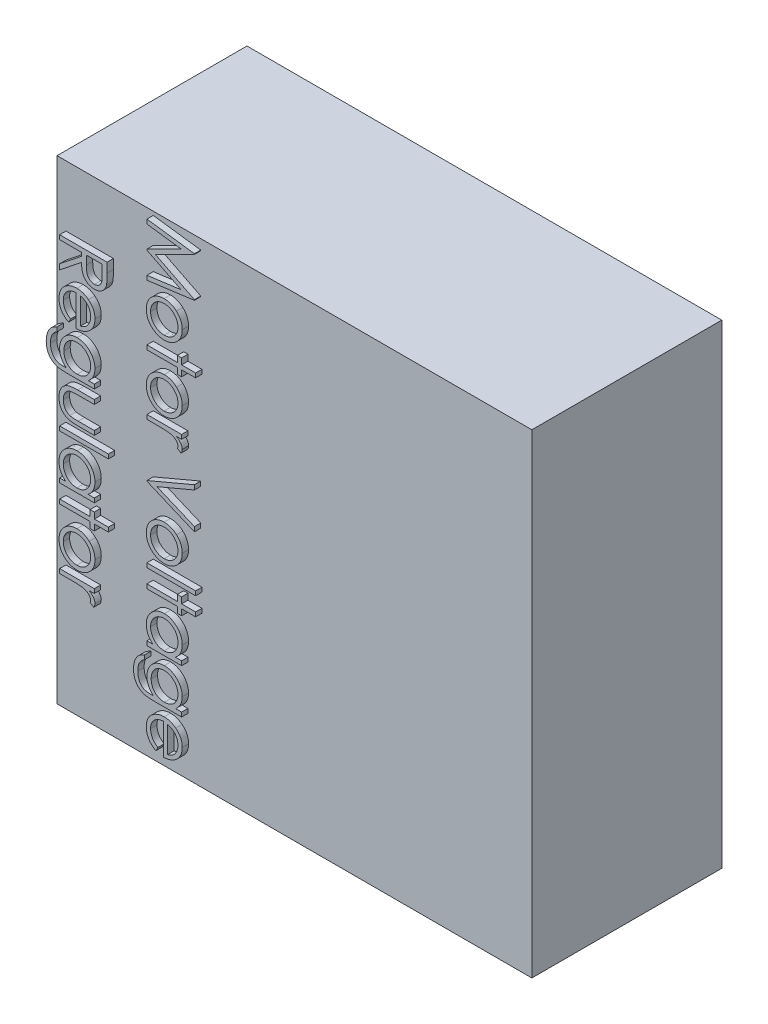
from build123d import *

# Parameters (mm, degrees)
SKETCH1_W           = 75
SKETCH1_H           = 75
BOSS_EXTRUDE1_DEPTH = 30
SKETCH2_W           = 7.692307693
SKETCH2_H           = 0.673076923
SKETCH2_W_2         = 7.692307692
BOSS_EXTRUDE2_DEPTH = 1


with BuildPart() as part:
    # Sketch1 → Boss-Extrude1 (new body)
    with BuildSketch(Plane.XY):
        Rectangle(SKETCH1_W, SKETCH1_H)
    extrude(amount=BOSS_EXTRUDE1_DEPTH)

    # Sketch2 → Boss-Extrude2 (add)
    # profile 1 of 21: a face of its own
    with BuildSketch(Plane.XY.offset(30)):
        Polygon((-22.305974537, 36.923076923), (-14.805974537, 35.932992788), (-14.805974537, 35.836838942), (-20.95982069, 32.740384615), (-14.805974537, 29.651442308), (-14.805974537, 29.553786058), (-22.305974537, 28.557692308), (-22.305974537, 29.233774038), (-16.909339921, 29.951923077), (-22.305974537, 32.659254808), (-22.305974537, 32.810997596), (-16.89732069, 35.528846154), (-22.305974537, 36.245492788), align=None)
    # profile 2 of 21: a face of its own
    with BuildSketch(Plane.XY.offset(30)):
        with BuildLine():
            add(Edge.make_bspline(
                [(-16.72905146, 24.564302885), (-16.7312348, 24.46146189), (-16.735515797, 24.259815833), (-16.781496008, 23.96454937), (-16.851222062, 23.682991383), (-16.949370553, 23.413934072), (-17.078145207, 23.159603085), (-17.233872084, 22.917727664), (-17.417604761, 22.688792417), (-17.559812594, 22.551605933), (-17.631996171, 22.481971154)],
                knots=[0, 0, 0, 0, 1.054042676, 2.066720093, 3.05716247, 4.025731183, 4.997454851, 5.974904663, 6.97207755, 8, 8, 8, 8], degree=3))
            add(Edge.make_bspline(
                [(-17.631996171, 22.481971154), (-17.701026141, 22.422009824), (-17.83775016, 22.30324758), (-18.059440759, 22.150963897), (-18.289026689, 22.01977484), (-18.529556675, 21.914639923), (-18.77893097, 21.831743444), (-19.038006708, 21.772888381), (-19.306211738, 21.737880663), (-19.488362819, 21.733160019), (-19.58061396, 21.730769231)],
                knots=[0, 0, 0, 0, 1.025258237, 2.030674902, 3.01204498, 3.988269485, 4.97094183, 5.956517959, 6.965070386, 8, 8, 8, 8], degree=3))
            add(Edge.make_bspline(
                [(-19.58061396, 21.730769231), (-19.673399798, 21.732872096), (-19.856748941, 21.737027457), (-20.126790437, 21.776335207), (-20.388636493, 21.837473245), (-20.641190808, 21.924970054), (-20.885225546, 22.037165954), (-21.119674168, 22.174074756), (-21.345001755, 22.336656075), (-21.55928526, 22.520953138), (-21.756807223, 22.724625345), (-21.928856182, 22.945626125), (-22.076877293, 23.179772652), (-22.194447211, 23.430261256), (-22.289216754, 23.693526312), (-22.354566453, 23.97124235), (-22.394431543, 24.263161625), (-22.39952668, 24.46251046), (-22.402128383, 24.564302885)],
                knots=[0, 0, 0, 0, 0.998669827, 1.973418153, 2.932281609, 3.89081133, 4.846438734, 5.82045571, 6.809776312, 7.834649874, 8.860672198, 9.859676908, 10.845817165, 11.837296335, 12.833502054, 13.853824644, 14.904110009, 16, 16, 16, 16], degree=3))
            add(Edge.make_bspline(
                [(-22.402128383, 24.564302885), (-22.399505154, 24.666589136), (-22.394367427, 24.866921927), (-22.354862993, 25.159940401), (-22.28851852, 25.438825711), (-22.195620438, 25.703336071), (-22.07591161, 25.95382366), (-21.929432119, 26.188834776), (-21.756720101, 26.409939798), (-21.559308866, 26.61367586), (-21.344995673, 26.797955802), (-21.119675747, 26.960541539), (-20.885225135, 27.097449194), (-20.641190918, 27.209645394), (-20.388636464, 27.297142123), (-20.126790445, 27.358280182), (-19.856748939, 27.397587927), (-19.673399797, 27.401743288), (-19.58061396, 27.403846154)],
                knots=[0, 0, 0, 0, 1.099861214, 2.154133753, 3.1731438, 4.178222029, 5.163564916, 6.153006591, 7.15072618, 8.175428628, 9.198983792, 10.187031731, 11.15979573, 12.114193814, 13.071490482, 14.029120454, 15.002614863, 16, 16, 16, 16], degree=3))
            add(Edge.make_bspline(
                [(-19.58061396, 27.403846154), (-19.488864218, 27.40143906), (-19.307215499, 27.396673429), (-19.039514655, 27.361700909), (-18.780877392, 27.303075431), (-18.532465658, 27.220079581), (-18.292989724, 27.113975601), (-18.062836515, 26.984629984), (-17.842148371, 26.830792914), (-17.705601056, 26.712503018), (-17.636503383, 26.652644231)],
                knots=[0, 0, 0, 0, 1.031353054, 2.041901799, 3.029428768, 4.008703097, 4.981709435, 5.96992636, 6.972712378, 8, 8, 8, 8], degree=3))
            add(Edge.make_bspline(
                [(-17.636503383, 26.652644231), (-17.563705971, 26.583108671), (-17.420537052, 26.446354758), (-17.237166889, 26.216362713), (-17.079340439, 25.975527757), (-16.950630593, 25.719556247), (-16.851400144, 25.449750803), (-16.781170575, 25.16610022), (-16.73571918, 24.869759047), (-16.731296183, 24.667136319), (-16.72905146, 24.564302885)],
                knots=[0, 0, 0, 0, 1.027951202, 2.021646915, 2.998468564, 3.9668038, 4.943370589, 5.93035926, 6.949632805, 8, 8, 8, 8], degree=3))
        make_face()
        with BuildLine():
            add(Edge.make_bspline(
                [(-17.402128383, 24.567307692), (-17.404195477, 24.640031063), (-17.408276303, 24.783600464), (-17.439311629, 24.994929324), (-17.488490815, 25.198368153), (-17.558334665, 25.394328884), (-17.648629584, 25.582053608), (-17.758909042, 25.761748875), (-17.889760398, 25.932931909), (-18.038582859, 26.094287655), (-18.20023015, 26.244110652), (-18.374050373, 26.373569515), (-18.555056962, 26.483854046), (-18.744189477, 26.57563127), (-18.943239093, 26.64401004), (-19.149984811, 26.693664828), (-19.364838867, 26.724672943), (-19.510898248, 26.72871512), (-19.585121171, 26.730769231)],
                knots=[0, 0, 0, 0, 1.021589593, 2.016807015, 2.994807536, 3.958602519, 4.934347097, 5.916793557, 6.916107818, 7.957073844, 8.998039869, 10.008589932, 10.997041759, 11.972786337, 12.956492182, 13.948170289, 14.957322718, 16, 16, 16, 16], degree=3))
            add(Edge.make_bspline(
                [(-19.585121171, 26.730769231), (-19.68102261, 26.727335123), (-19.871369033, 26.720519062), (-20.151616266, 26.664809949), (-20.421167278, 26.572274517), (-20.676776604, 26.444674354), (-20.913685594, 26.287530914), (-21.126715276, 26.103783891), (-21.307650369, 25.890892916), (-21.459819829, 25.656107338), (-21.579653136, 25.402754364), (-21.665589552, 25.135081567), (-21.720701309, 24.855526189), (-21.726243716, 24.66422134), (-21.72905146, 24.567307692)],
                knots=[0, 0, 0, 0, 1.016977094, 2.018509362, 3.018404954, 4.033172147, 5.041280572, 6.028085189, 7.007940189, 7.995502847, 8.989109012, 9.972200833, 10.97273166, 12, 12, 12, 12], degree=3))
            add(Edge.make_bspline(
                [(-21.72905146, 24.567307692), (-21.726259981, 24.47038847), (-21.720749678, 24.279072618), (-21.665310338, 23.999128273), (-21.580026818, 23.730721871), (-21.459684484, 23.477105475), (-21.30822553, 23.242212975), (-21.125684505, 23.030842188), (-20.91424561, 22.84551276), (-20.677090729, 22.68821372), (-20.420769901, 22.562669549), (-20.151665933, 22.469698949), (-19.871356384, 22.414123443), (-19.681018372, 22.407289347), (-19.585121171, 22.403846154)],
                knots=[0, 0, 0, 0, 1.027082318, 2.027431966, 3.015401697, 4.008827937, 4.996211763, 5.971861488, 6.96198607, 7.969911943, 8.982141629, 9.981856156, 10.983207064, 12, 12, 12, 12], degree=3))
            add(Edge.make_bspline(
                [(-19.585121171, 22.403846154), (-19.510892322, 22.405884981), (-19.364821279, 22.409897082), (-19.150052048, 22.441123955), (-18.942830178, 22.490007403), (-18.744991635, 22.561380499), (-18.554133228, 22.650007875), (-18.374593906, 22.762975205), (-18.200119652, 22.891831075), (-18.03868029, 23.041928993), (-17.889216635, 23.203266574), (-17.759385704, 23.375735629), (-17.648566607, 23.555514351), (-17.558323545, 23.743298401), (-17.488759646, 23.938815682), (-17.439097397, 24.14163686), (-17.408389461, 24.352029856), (-17.404228757, 24.495089453), (-17.402128383, 24.567307692)],
                knots=[0, 0, 0, 0, 1.043020522, 2.052505155, 3.044509714, 4.030878336, 5.003918577, 5.996372628, 7.007255355, 8.048564058, 9.08987276, 10.095126797, 11.077896669, 12.053962454, 13.01807471, 13.98956039, 14.985105429, 16, 16, 16, 16], degree=3))
        make_face(mode=Mode.SUBTRACT)
    # profile 3 of 21: a face of its own
    with BuildSketch(Plane.XY.offset(30)):
        Polygon((-14.613666844, 19.711538462), (-14.613666844, 19.038461538), (-16.825205306, 19.038461538), (-16.825205306, 18.076923077), (-17.498282229, 18.076923077), (-17.498282229, 19.038461538), (-22.305974537, 19.038461538), (-22.305974537, 19.711538462), (-17.498282229, 19.711538462), (-17.498282229, 20.673076923), (-16.825205306, 20.673076923), (-16.825205306, 19.711538462), align=None)
    # profile 4 of 21: a face of its own
    with BuildSketch(Plane.XY.offset(30)):
        with BuildLine():
            add(Edge.make_bspline(
                [(-16.72905146, 14.1796875), (-16.7312348, 14.076846505), (-16.735515797, 13.875200448), (-16.781496008, 13.579933985), (-16.851222062, 13.298375998), (-16.949370553, 13.029318687), (-17.078145207, 12.7749877), (-17.233872084, 12.533112279), (-17.417604761, 12.304177032), (-17.559812594, 12.166990548), (-17.631996171, 12.097355769)],
                knots=[0, 0, 0, 0, 1.054042676, 2.066720093, 3.05716247, 4.025731183, 4.997454851, 5.974904663, 6.97207755, 8, 8, 8, 8], degree=3))
            add(Edge.make_bspline(
                [(-17.631996171, 12.097355769), (-17.701026141, 12.037394439), (-17.83775016, 11.918632196), (-18.059440759, 11.766348513), (-18.289026689, 11.635159455), (-18.529556675, 11.530024539), (-18.77893097, 11.447128059), (-19.038006708, 11.388272996), (-19.306211738, 11.353265278), (-19.488362819, 11.348544635), (-19.58061396, 11.346153846)],
                knots=[0, 0, 0, 0, 1.025258237, 2.030674902, 3.01204498, 3.988269485, 4.97094183, 5.956517959, 6.965070386, 8, 8, 8, 8], degree=3))
            add(Edge.make_bspline(
                [(-19.58061396, 11.346153846), (-19.673399798, 11.348256712), (-19.856748941, 11.352412072), (-20.126790437, 11.391719823), (-20.388636493, 11.45285786), (-20.641190808, 11.540354669), (-20.885225546, 11.652550569), (-21.119674168, 11.789459372), (-21.345001755, 11.95204069), (-21.55928526, 12.136337753), (-21.756807223, 12.340009961), (-21.928856182, 12.561010741), (-22.076877293, 12.795157267), (-22.194447211, 13.045645871), (-22.289216754, 13.308910927), (-22.354566453, 13.586626965), (-22.394431543, 13.878546241), (-22.39952668, 14.077895076), (-22.402128383, 14.1796875)],
                knots=[0, 0, 0, 0, 0.998669827, 1.973418153, 2.932281609, 3.89081133, 4.846438734, 5.82045571, 6.809776312, 7.834649874, 8.860672198, 9.859676908, 10.845817165, 11.837296335, 12.833502054, 13.853824644, 14.904110009, 16, 16, 16, 16], degree=3))
            add(Edge.make_bspline(
                [(-22.402128383, 14.1796875), (-22.399505154, 14.281973751), (-22.394367427, 14.482306542), (-22.354862993, 14.775325017), (-22.28851852, 15.054210326), (-22.195620438, 15.318720687), (-22.07591161, 15.569208275), (-21.929432119, 15.804219391), (-21.756720101, 16.025324413), (-21.559308866, 16.229060476), (-21.344995673, 16.413340418), (-21.119675747, 16.575926154), (-20.885225135, 16.712833809), (-20.641190918, 16.825030009), (-20.388636464, 16.912526738), (-20.126790445, 16.973664797), (-19.856748939, 17.012972542), (-19.673399797, 17.017127903), (-19.58061396, 17.019230769)],
                knots=[0, 0, 0, 0, 1.099861214, 2.154133753, 3.1731438, 4.178222029, 5.163564916, 6.153006591, 7.15072618, 8.175428628, 9.198983792, 10.187031731, 11.15979573, 12.114193814, 13.071490482, 14.029120454, 15.002614863, 16, 16, 16, 16], degree=3))
            add(Edge.make_bspline(
                [(-19.58061396, 17.019230769), (-19.488864218, 17.016823676), (-19.307215499, 17.012058044), (-19.039514655, 16.977085524), (-18.780877392, 16.918460046), (-18.532465658, 16.835464197), (-18.292989724, 16.729360216), (-18.062836515, 16.600014599), (-17.842148371, 16.44617753), (-17.705601056, 16.327887633), (-17.636503383, 16.268028846)],
                knots=[0, 0, 0, 0, 1.031353054, 2.041901799, 3.029428768, 4.008703097, 4.981709435, 5.96992636, 6.972712378, 8, 8, 8, 8], degree=3))
            add(Edge.make_bspline(
                [(-17.636503383, 16.268028846), (-17.563705971, 16.198493287), (-17.420537052, 16.061739373), (-17.237166889, 15.831747328), (-17.079340439, 15.590912372), (-16.950630593, 15.334940863), (-16.851400144, 15.065135418), (-16.781170575, 14.781484836), (-16.73571918, 14.485143662), (-16.731296183, 14.282520935), (-16.72905146, 14.1796875)],
                knots=[0, 0, 0, 0, 1.027951202, 2.021646915, 2.998468564, 3.9668038, 4.943370589, 5.93035926, 6.949632805, 8, 8, 8, 8], degree=3))
        make_face()
        with BuildLine():
            add(Edge.make_bspline(
                [(-17.402128383, 14.182692308), (-17.404195477, 14.255415679), (-17.408276303, 14.398985079), (-17.439311629, 14.610313939), (-17.488490815, 14.813752768), (-17.558334665, 15.0097135), (-17.648629584, 15.197438223), (-17.758909042, 15.377133491), (-17.889760398, 15.548316524), (-18.038582859, 15.70967227), (-18.20023015, 15.859495267), (-18.374050373, 15.98895413), (-18.555056962, 16.099238661), (-18.744189477, 16.191015885), (-18.943239093, 16.259394656), (-19.149984811, 16.309049443), (-19.364838867, 16.340057558), (-19.510898248, 16.344099735), (-19.585121171, 16.346153846)],
                knots=[0, 0, 0, 0, 1.021589593, 2.016807015, 2.994807536, 3.958602519, 4.934347097, 5.916793557, 6.916107818, 7.957073844, 8.998039869, 10.008589932, 10.997041759, 11.972786337, 12.956492182, 13.948170289, 14.957322718, 16, 16, 16, 16], degree=3))
            add(Edge.make_bspline(
                [(-19.585121171, 16.346153846), (-19.68102261, 16.342719738), (-19.871369033, 16.335903677), (-20.151616266, 16.280194564), (-20.421167278, 16.187659132), (-20.676776604, 16.060058969), (-20.913685594, 15.90291553), (-21.126715276, 15.719168506), (-21.307650369, 15.506277532), (-21.459819829, 15.271491953), (-21.579653136, 15.01813898), (-21.665589552, 14.750466183), (-21.720701309, 14.470910804), (-21.726243716, 14.279605955), (-21.72905146, 14.182692308)],
                knots=[0, 0, 0, 0, 1.016977094, 2.018509362, 3.018404954, 4.033172147, 5.041280572, 6.028085189, 7.007940189, 7.995502847, 8.989109012, 9.972200833, 10.97273166, 12, 12, 12, 12], degree=3))
            add(Edge.make_bspline(
                [(-21.72905146, 14.182692308), (-21.726259981, 14.085773085), (-21.720749678, 13.894457233), (-21.665310338, 13.614512889), (-21.580026818, 13.346106486), (-21.459684484, 13.092490091), (-21.30822553, 12.85759759), (-21.125684505, 12.646226804), (-20.91424561, 12.460897375), (-20.677090729, 12.303598335), (-20.420769901, 12.178054164), (-20.151665933, 12.085083565), (-19.871356384, 12.029508058), (-19.681018372, 12.022673963), (-19.585121171, 12.019230769)],
                knots=[0, 0, 0, 0, 1.027082318, 2.027431966, 3.015401697, 4.008827937, 4.996211763, 5.971861488, 6.96198607, 7.969911943, 8.982141629, 9.981856156, 10.983207064, 12, 12, 12, 12], degree=3))
            add(Edge.make_bspline(
                [(-19.585121171, 12.019230769), (-19.510892322, 12.021269597), (-19.364821279, 12.025281698), (-19.150052048, 12.05650857), (-18.942830178, 12.105392019), (-18.744991635, 12.176765115), (-18.554133228, 12.26539249), (-18.374593906, 12.37835982), (-18.200119652, 12.50721569), (-18.03868029, 12.657313609), (-17.889216635, 12.818651189), (-17.759385704, 12.991120244), (-17.648566607, 13.170898967), (-17.558323545, 13.358683016), (-17.488759646, 13.554200298), (-17.439097397, 13.757021476), (-17.408389461, 13.967414471), (-17.404228757, 14.110474069), (-17.402128383, 14.182692308)],
                knots=[0, 0, 0, 0, 1.043020522, 2.052505155, 3.044509714, 4.030878336, 5.003918577, 5.996372628, 7.007255355, 8.048564058, 9.08987276, 10.095126797, 11.077896669, 12.053962454, 13.01807471, 13.98956039, 14.985105429, 16, 16, 16, 16], degree=3))
        make_face(mode=Mode.SUBTRACT)
    # profile 5 of 21: a face of its own
    with BuildSketch(Plane.XY.offset(30)):
        with BuildLine():
            Line((-16.825205306, 10.192307692), (-16.825205306, 9.519230769))
            Line((-16.825205306, 9.519230769), (-17.631996171, 9.519230769))
            add(Edge.make_bspline(
                [(-17.631996171, 9.519230769), (-17.55686868, 9.469546542), (-17.413187936, 9.374525843), (-17.223284265, 9.216492108), (-17.065347978, 9.054666661), (-16.940921263, 8.887036996), (-16.846973437, 8.715004433), (-16.777581522, 8.541429616), (-16.73724573, 8.362716886), (-16.731786542, 8.242380512), (-16.72905146, 8.182091346)],
                knots=[0, 0, 0, 0, 1.280622107, 2.44917983, 3.507334186, 4.490567186, 5.408878616, 6.288712897, 7.142636019, 8, 8, 8, 8], degree=3))
            add(Edge.make_bspline(
                [(-16.72905146, 8.182091346), (-16.731545516, 8.135305493), (-16.736651223, 8.039527848), (-16.77431922, 7.894100459), (-16.832176303, 7.743647859), (-16.887915266, 7.646557792), (-16.91685194, 7.596153846)],
                knots=[0, 0, 0, 0, 0.90119973, 1.844890732, 2.881183062, 4, 4, 4, 4], degree=3))
            Line((-16.91685194, 7.596153846), (-17.499784633, 7.965745192))
            add(Edge.make_bspline(
                [(-17.499784633, 7.965745192), (-17.485341205, 7.998121666), (-17.457924815, 8.059578412), (-17.425477651, 8.149481054), (-17.406372117, 8.232369632), (-17.403477722, 8.285177257), (-17.402128383, 8.309795673)],
                knots=[0, 0, 0, 0, 1.180555205, 2.24091978, 3.179933427, 4, 4, 4, 4], degree=3))
            add(Edge.make_bspline(
                [(-17.402128383, 8.309795673), (-17.405596092, 8.364350716), (-17.412606039, 8.474633277), (-17.471642334, 8.636312382), (-17.563014501, 8.793910671), (-17.667956339, 8.917478443), (-17.767213187, 9.013888117), (-17.854363296, 9.082725034), (-17.95201859, 9.145912308), (-18.058586042, 9.206274166), (-18.175863162, 9.261274214), (-18.302684658, 9.312605404), (-18.439195556, 9.359017323), (-18.534300969, 9.385482122), (-18.583017806, 9.399038462)],
                knots=[0, 0, 0, 0, 1.135927944, 2.296268816, 3.551388088, 4.924624343, 5.663947748, 6.437790805, 7.238014523, 8.089896346, 8.992356783, 9.939655789, 10.944608424, 12, 12, 12, 12], degree=3))
            add(Edge.make_bspline(
                [(-18.583017806, 9.399038462), (-18.626468892, 9.409179304), (-18.722709746, 9.431640501), (-18.884170871, 9.453479511), (-19.074935854, 9.475057049), (-19.295535696, 9.490264088), (-19.545419504, 9.504359893), (-19.824967959, 9.512310069), (-20.134467997, 9.518959656), (-20.350841611, 9.519137657), (-20.464027421, 9.519230769)],
                knots=[0, 0, 0, 0, 0.566838948, 1.255505196, 2.06880316, 3.007127437, 4.065329342, 5.249902469, 6.561414163, 8, 8, 8, 8], degree=3))
            Line((-20.464027421, 9.519230769), (-22.305974537, 9.519230769))
            Line((-22.305974537, 9.519230769), (-22.305974537, 10.192307692))
            Line((-22.305974537, 10.192307692), (-16.825205306, 10.192307692))
        make_face()
    # profile 6 of 21: a face of its own
    with BuildSketch(Plane.XY.offset(30)):
        Polygon((-14.805974537, 4.326923077), (-14.805974537, 3.605769231), (-20.716431267, 1.105769231), (-14.805974537, -1.394230769), (-14.805974537, -2.115384615), (-22.305974537, 1.057692308), (-22.305974537, 1.153846154), align=None)
    # profile 7 of 21: a face of its own
    with BuildSketch(Plane.XY.offset(30)):
        with BuildLine():
            add(Edge.make_bspline(
                [(-16.72905146, -6.012620192), (-16.7312348, -6.115461187), (-16.735515797, -6.317107244), (-16.781496008, -6.612373707), (-16.851222062, -6.893931694), (-16.949370553, -7.162989005), (-17.078145207, -7.417319992), (-17.233872084, -7.659195413), (-17.417604761, -7.88813066), (-17.559812594, -8.025317144), (-17.631996171, -8.094951923)],
                knots=[0, 0, 0, 0, 1.054042676, 2.066720093, 3.05716247, 4.025731183, 4.997454851, 5.974904663, 6.97207755, 8, 8, 8, 8], degree=3))
            add(Edge.make_bspline(
                [(-17.631996171, -8.094951923), (-17.701026141, -8.154913253), (-17.83775016, -8.273675497), (-18.059440759, -8.42595918), (-18.289026689, -8.557148237), (-18.529556675, -8.662283154), (-18.77893097, -8.745179633), (-19.038006708, -8.804034696), (-19.306211738, -8.839042414), (-19.488362819, -8.843763057), (-19.58061396, -8.846153846)],
                knots=[0, 0, 0, 0, 1.025258237, 2.030674902, 3.01204498, 3.988269485, 4.97094183, 5.956517959, 6.965070386, 8, 8, 8, 8], degree=3))
            add(Edge.make_bspline(
                [(-19.58061396, -8.846153846), (-19.673399798, -8.844050981), (-19.856748941, -8.83989562), (-20.126790437, -8.80058787), (-20.388636493, -8.739449832), (-20.641190808, -8.651953023), (-20.885225546, -8.539757123), (-21.119674168, -8.402848321), (-21.345001755, -8.240267002), (-21.55928526, -8.055969939), (-21.756807223, -7.852297731), (-21.928856182, -7.631296952), (-22.076877293, -7.397150425), (-22.194447211, -7.146661821), (-22.289216754, -6.883396765), (-22.354566453, -6.605680727), (-22.394431543, -6.313761452), (-22.39952668, -6.114412617), (-22.402128383, -6.012620192)],
                knots=[0, 0, 0, 0, 0.998669827, 1.973418153, 2.932281609, 3.89081133, 4.846438734, 5.82045571, 6.809776312, 7.834649874, 8.860672198, 9.859676908, 10.845817165, 11.837296335, 12.833502054, 13.853824644, 14.904110009, 16, 16, 16, 16], degree=3))
            add(Edge.make_bspline(
                [(-22.402128383, -6.012620192), (-22.399505154, -5.910333941), (-22.394367427, -5.71000115), (-22.354862993, -5.416982676), (-22.28851852, -5.138097366), (-22.195620438, -4.873587006), (-22.07591161, -4.623099417), (-21.929432119, -4.388088301), (-21.756720101, -4.166983279), (-21.559308866, -3.963247217), (-21.344995673, -3.778967274), (-21.119675747, -3.616381538), (-20.885225135, -3.479473883), (-20.641190918, -3.367277683), (-20.388636464, -3.279780954), (-20.126790445, -3.218642895), (-19.856748939, -3.17933515), (-19.673399797, -3.175179789), (-19.58061396, -3.173076923)],
                knots=[0, 0, 0, 0, 1.099861214, 2.154133753, 3.1731438, 4.178222029, 5.163564916, 6.153006591, 7.15072618, 8.175428628, 9.198983792, 10.187031731, 11.15979573, 12.114193814, 13.071490482, 14.029120454, 15.002614863, 16, 16, 16, 16], degree=3))
            add(Edge.make_bspline(
                [(-19.58061396, -3.173076923), (-19.488864218, -3.175484017), (-19.307215499, -3.180249648), (-19.039514655, -3.215222168), (-18.780877392, -3.273847646), (-18.532465658, -3.356843496), (-18.292989724, -3.462947476), (-18.062836515, -3.592293093), (-17.842148371, -3.746130163), (-17.705601056, -3.864420059), (-17.636503383, -3.924278846)],
                knots=[0, 0, 0, 0, 1.031353054, 2.041901799, 3.029428768, 4.008703097, 4.981709435, 5.96992636, 6.972712378, 8, 8, 8, 8], degree=3))
            add(Edge.make_bspline(
                [(-17.636503383, -3.924278846), (-17.563705971, -3.993814406), (-17.420537052, -4.130568319), (-17.237166889, -4.360560364), (-17.079340439, -4.60139532), (-16.950630593, -4.85736683), (-16.851400144, -5.127172274), (-16.781170575, -5.410822856), (-16.73571918, -5.70716403), (-16.731296183, -5.909786757), (-16.72905146, -6.012620192)],
                knots=[0, 0, 0, 0, 1.027951202, 2.021646915, 2.998468564, 3.9668038, 4.943370589, 5.93035926, 6.949632805, 8, 8, 8, 8], degree=3))
        make_face()
        with BuildLine():
            add(Edge.make_bspline(
                [(-17.402128383, -6.009615385), (-17.404195477, -5.936892013), (-17.408276303, -5.793322613), (-17.439311629, -5.581993753), (-17.488490815, -5.378554924), (-17.558334665, -5.182594193), (-17.648629584, -4.994869469), (-17.758909042, -4.815174202), (-17.889760398, -4.643991168), (-18.038582859, -4.482635422), (-18.20023015, -4.332812425), (-18.374050373, -4.203353562), (-18.555056962, -4.093069031), (-18.744189477, -4.001291807), (-18.943239093, -3.932913037), (-19.149984811, -3.883258249), (-19.364838867, -3.852250134), (-19.510898248, -3.848207957), (-19.585121171, -3.846153846)],
                knots=[0, 0, 0, 0, 1.021589593, 2.016807015, 2.994807536, 3.958602519, 4.934347097, 5.916793557, 6.916107818, 7.957073844, 8.998039869, 10.008589932, 10.997041759, 11.972786337, 12.956492182, 13.948170289, 14.957322718, 16, 16, 16, 16], degree=3))
            add(Edge.make_bspline(
                [(-19.585121171, -3.846153846), (-19.68102261, -3.849587954), (-19.871369033, -3.856404015), (-20.151616266, -3.912113128), (-20.421167278, -4.00464856), (-20.676776604, -4.132248723), (-20.913685594, -4.289392162), (-21.126715276, -4.473139186), (-21.307650369, -4.686030161), (-21.459819829, -4.920815739), (-21.579653136, -5.174168713), (-21.665589552, -5.441841509), (-21.720701309, -5.721396888), (-21.726243716, -5.912701737), (-21.72905146, -6.009615385)],
                knots=[0, 0, 0, 0, 1.016977094, 2.018509362, 3.018404954, 4.033172147, 5.041280572, 6.028085189, 7.007940189, 7.995502847, 8.989109012, 9.972200833, 10.97273166, 12, 12, 12, 12], degree=3))
            add(Edge.make_bspline(
                [(-21.72905146, -6.009615385), (-21.726259981, -6.106534607), (-21.720749678, -6.297850459), (-21.665310338, -6.577794804), (-21.580026818, -6.846201206), (-21.459684484, -7.099817602), (-21.30822553, -7.334710102), (-21.125684505, -7.546080889), (-20.91424561, -7.731410317), (-20.677090729, -7.888709357), (-20.420769901, -8.014253528), (-20.151665933, -8.107224128), (-19.871356384, -8.162799634), (-19.681018372, -8.16963373), (-19.585121171, -8.173076923)],
                knots=[0, 0, 0, 0, 1.027082318, 2.027431966, 3.015401697, 4.008827937, 4.996211763, 5.971861488, 6.96198607, 7.969911943, 8.982141629, 9.981856156, 10.983207064, 12, 12, 12, 12], degree=3))
            add(Edge.make_bspline(
                [(-19.585121171, -8.173076923), (-19.510892322, -8.171038096), (-19.364821279, -8.167025995), (-19.150052048, -8.135799122), (-18.942830178, -8.086915674), (-18.744991635, -8.015542578), (-18.554133228, -7.926915202), (-18.374593906, -7.813947872), (-18.200119652, -7.685092002), (-18.03868029, -7.534994084), (-17.889216635, -7.373656503), (-17.759385704, -7.201187448), (-17.648566607, -7.021408726), (-17.558323545, -6.833624676), (-17.488759646, -6.638107395), (-17.439097397, -6.435286217), (-17.408389461, -6.224893221), (-17.404228757, -6.081833624), (-17.402128383, -6.009615385)],
                knots=[0, 0, 0, 0, 1.043020522, 2.052505155, 3.044509714, 4.030878336, 5.003918577, 5.996372628, 7.007255355, 8.048564058, 9.08987276, 10.095126797, 11.077896669, 12.053962454, 13.01807471, 13.98956039, 14.985105429, 16, 16, 16, 16], degree=3))
        make_face(mode=Mode.SUBTRACT)
    # profile 8 of 21: a face of its own
    with BuildSketch(Plane.XY.offset(30)):
        with Locations((-18.459820691, -10.432692307)):
            Rectangle(SKETCH2_W, SKETCH2_H)
    # profile 9 of 21: a face of its own
    with BuildSketch(Plane.XY.offset(30)):
        Polygon((-14.613666844, -12.980769231), (-14.613666844, -13.653846154), (-16.825205306, -13.653846154), (-16.825205306, -14.615384615), (-17.498282229, -14.615384615), (-17.498282229, -13.653846154), (-22.305974537, -13.653846154), (-22.305974537, -12.980769231), (-17.498282229, -12.980769231), (-17.498282229, -12.019230769), (-16.825205306, -12.019230769), (-16.825205306, -12.980769231), align=None)
    # profile 10 of 21: a face of its own
    with BuildSketch(Plane.XY.offset(30)):
        with BuildLine():
            Line((-16.825205306, -21.442307692), (-22.305974537, -21.442307692))
            Line((-22.305974537, -21.442307692), (-22.305974537, -20.769230769))
            Line((-22.305974537, -20.769230769), (-21.35795771, -20.769230769))
            add(Edge.make_bspline(
                [(-21.35795771, -20.769230769), (-21.443779998, -20.693349231), (-21.611263272, -20.545265456), (-21.829414193, -20.297979772), (-22.011216667, -20.036947377), (-22.156688422, -19.761285579), (-22.26679352, -19.471819151), (-22.344222617, -19.169373577), (-22.394626844, -18.854351943), (-22.399605436, -18.639518051), (-22.402128383, -18.530649038)],
                knots=[0, 0, 0, 0, 1.074295371, 2.096500925, 3.086030275, 4.053105238, 5.014108356, 5.985331429, 6.979048527, 8, 8, 8, 8], degree=3))
            add(Edge.make_bspline(
                [(-22.402128383, -18.530649038), (-22.399500878, -18.433860303), (-22.394319323, -18.242988631), (-22.354108116, -17.962215819), (-22.289565653, -17.692004177), (-22.199692811, -17.432181492), (-22.081094709, -17.184508277), (-21.937574624, -16.947588959), (-21.768339093, -16.720870611), (-21.574113445, -16.50866494), (-21.363379891, -16.313006053), (-21.137958949, -16.141824289), (-20.900946771, -15.99674217), (-20.652409971, -15.877510652), (-20.392530229, -15.785243052), (-20.121485827, -15.721049768), (-19.839727769, -15.680881893), (-19.647856544, -15.675702963), (-19.550565883, -15.673076923)],
                knots=[0, 0, 0, 0, 1.034036272, 2.039165313, 3.024406509, 3.999331371, 4.971254918, 5.953351348, 6.95522652, 7.989525907, 9.023492927, 10.024309745, 11.009187477, 11.988246066, 12.964946762, 13.950187958, 14.960617622, 16, 16, 16, 16], degree=3))
            add(Edge.make_bspline(
                [(-19.550565883, -15.673076923), (-19.455286112, -15.675761208), (-19.266923145, -15.681067894), (-18.989903232, -15.720619959), (-18.723056721, -15.787080086), (-18.467372109, -15.880526162), (-18.221819671, -15.999821083), (-17.988320613, -16.147398286), (-17.763303056, -16.318518365), (-17.553982915, -16.51626835), (-17.361333044, -16.730378645), (-17.191686237, -16.95836546), (-17.048534125, -17.197386029), (-16.932165375, -17.447919621), (-16.839691683, -17.708192238), (-16.775228615, -17.98018103), (-16.737334651, -18.262649104), (-16.731839053, -18.454412429), (-16.72905146, -18.551682692)],
                knots=[0, 0, 0, 0, 1.02050356, 2.017480486, 2.990790918, 3.96161403, 4.928589988, 5.909588639, 6.91611943, 7.952353252, 8.989586576, 9.99823133, 10.991940466, 11.968822692, 12.952985106, 13.945868367, 14.958059758, 16, 16, 16, 16], degree=3))
            add(Edge.make_bspline(
                [(-16.72905146, -18.551682692), (-16.732117355, -18.663543887), (-16.73812943, -18.882898411), (-16.788694041, -19.204160667), (-16.87306925, -19.508356724), (-16.989031633, -19.797240007), (-17.141986981, -20.069689869), (-17.336675422, -20.322353178), (-17.568649304, -20.560316455), (-17.747347446, -20.698238699), (-17.839327902, -20.769230769)],
                knots=[0, 0, 0, 0, 1.03879612, 2.037030165, 3.012306674, 3.966139504, 4.922386257, 5.905048148, 6.921675258, 8, 8, 8, 8], degree=3))
            Line((-17.839327902, -20.769230769), (-16.825205306, -20.769230769))
            Line((-16.825205306, -20.769230769), (-16.825205306, -21.442307692))
        make_face()
        with BuildLine():
            add(Edge.make_bspline(
                [(-17.402128383, -18.560697115), (-17.405628997, -18.462309189), (-17.412538654, -18.268107072), (-17.466482403, -17.983013639), (-17.556233057, -17.710195962), (-17.678987689, -17.451037907), (-17.833306425, -17.209561127), (-18.020100724, -16.993954992), (-18.233430464, -16.801639999), (-18.475089213, -16.642637278), (-18.731204677, -16.508582167), (-19.000964625, -16.416653643), (-19.276885132, -16.35548142), (-19.464102925, -16.349271133), (-19.558077902, -16.346153846)],
                knots=[0, 0, 0, 0, 1.031093775, 2.03521511, 3.029845951, 4.035119871, 5.034286494, 6.024708811, 7.017619509, 8.03559408, 9.050082311, 10.039808432, 11.016071318, 12, 12, 12, 12], degree=3))
            add(Edge.make_bspline(
                [(-19.558077902, -16.346153846), (-19.651472768, -16.350186884), (-19.837896424, -16.358237152), (-20.114636728, -16.415041188), (-20.383310695, -16.513463325), (-20.642973919, -16.644458614), (-20.885128702, -16.807027888), (-21.102630082, -16.997746793), (-21.290173505, -17.2161023), (-21.447147408, -17.458102864), (-21.573503938, -17.71617824), (-21.662603406, -17.987703186), (-21.718864924, -18.267906924), (-21.725644526, -18.458772422), (-21.72905146, -18.5546875)],
                knots=[0, 0, 0, 0, 0.979154363, 1.954470772, 2.947816011, 3.971783346, 4.997163654, 5.998045606, 6.995988793, 8.00538986, 9.015323546, 10.000094788, 10.994993517, 12, 12, 12, 12], degree=3))
            add(Edge.make_bspline(
                [(-21.72905146, -18.5546875), (-21.725547665, -18.652084434), (-21.718596689, -18.845304609), (-21.663750793, -19.131069053), (-21.575116069, -19.408815339), (-21.450604475, -19.674411902), (-21.296999273, -19.92165144), (-21.116380197, -20.143270243), (-20.908081425, -20.332507675), (-20.677318569, -20.491148218), (-20.425522301, -20.616466295), (-20.156294165, -20.704854756), (-19.871749907, -20.759141785), (-19.677011766, -20.765821274), (-19.577609152, -20.769230769)],
                knots=[0, 0, 0, 0, 1.017484689, 2.018529338, 3.030031036, 4.058138743, 5.076350332, 6.065651025, 7.036469986, 8.00785331, 8.984076697, 9.96571663, 10.961615403, 12, 12, 12, 12], degree=3))
            add(Edge.make_bspline(
                [(-19.577609152, -20.769230769), (-19.501885259, -20.76717433), (-19.352836673, -20.763126607), (-19.133991575, -20.732204423), (-18.924563691, -20.683013595), (-18.724323794, -20.61370656), (-18.534412303, -20.522630803), (-18.353340575, -20.412900863), (-18.18279527, -20.282266018), (-18.022992367, -20.134701817), (-17.877965201, -19.971358181), (-17.750139475, -19.797663393), (-17.641963736, -19.614054469), (-17.555394851, -19.420660291), (-17.48486935, -19.218970395), (-17.438288476, -19.007051621), (-17.406201443, -18.787039723), (-17.403500365, -18.636939035), (-17.402128383, -18.560697115)],
                knots=[0, 0, 0, 0, 1.050062701, 2.066855696, 3.059271411, 4.030305351, 4.999747758, 5.975466543, 6.961907836, 7.974539719, 8.98812422, 9.98710676, 10.961662635, 11.93785114, 12.922015094, 13.919620009, 14.94329489, 16, 16, 16, 16], degree=3))
        make_face(mode=Mode.SUBTRACT)
    # profile 11 of 21: a face of its own
    with BuildSketch(Plane.XY.offset(30)):
        with BuildLine():
            Line((-16.825205306, -27.788461538), (-16.825205306, -28.461538462))
            Line((-16.825205306, -28.461538462), (-21.17466444, -28.461538462))
            add(Edge.make_bspline(
                [(-21.17466444, -28.461538462), (-21.267316429, -28.460944799), (-21.446157085, -28.459798887), (-21.704753398, -28.451546806), (-21.943609296, -28.434145355), (-22.163814136, -28.414412466), (-22.364347229, -28.386026645), (-22.545806953, -28.351363001), (-22.708367444, -28.312286546), (-22.808492103, -28.277957508), (-22.855854344, -28.26171875)],
                knots=[0, 0, 0, 0, 1.307562039, 2.523909702, 3.650326591, 4.686913197, 5.643429486, 6.506965704, 7.293745905, 8, 8, 8, 8], degree=3))
            add(Edge.make_bspline(
                [(-22.855854344, -28.26171875), (-22.917420605, -28.237744132), (-23.038712335, -28.19051172), (-23.210612258, -28.102009175), (-23.372611403, -28.00306006), (-23.52285872, -27.889646661), (-23.663718135, -27.764638179), (-23.792729946, -27.625739105), (-23.911896425, -27.475419183), (-24.018859897, -27.312455125), (-24.112588182, -27.138497852), (-24.195548097, -26.955860983), (-24.267197643, -26.765072497), (-24.320976283, -26.564297253), (-24.367542423, -26.356584986), (-24.397854773, -26.139520354), (-24.418483545, -25.914364004), (-24.420391275, -25.76126681), (-24.421359152, -25.68359375)],
                knots=[0, 0, 0, 0, 0.981884813, 1.934411902, 2.870642727, 3.801527012, 4.729816098, 5.667674509, 6.616731011, 7.579249157, 8.562291171, 9.552107921, 10.560574871, 11.588648803, 12.640348669, 13.724070705, 14.845319185, 16, 16, 16, 16], degree=3))
            add(Edge.make_bspline(
                [(-24.421359152, -25.68359375), (-24.419527893, -25.570268192), (-24.415950953, -25.348912931), (-24.374127986, -25.026203653), (-24.315376101, -24.720114853), (-24.225514437, -24.434520084), (-24.116003052, -24.170523031), (-23.991271707, -23.929308383), (-23.846808199, -23.714843443), (-23.682939383, -23.521688728), (-23.488000196, -23.347394394), (-23.258293525, -23.183404604), (-22.990291479, -23.025560566), (-22.79359304, -22.933056218), (-22.690589921, -22.884615385)],
                knots=[0, 0, 0, 0, 1.157931887, 2.261752077, 3.322178827, 4.340878186, 5.316509817, 6.24181319, 7.112369066, 7.954886437, 8.824930176, 9.778504873, 10.836691706, 12, 12, 12, 12], degree=3))
            Line((-22.690589921, -22.884615385), (-22.690589921, -23.557692308))
            add(Edge.make_bspline(
                [(-22.690589921, -23.557692308), (-22.776531084, -23.611825613), (-22.944535473, -23.71764956), (-23.162063664, -23.915539162), (-23.347963732, -24.132409861), (-23.497772533, -24.375580611), (-23.610722086, -24.646063215), (-23.691240579, -24.9440204), (-23.739446865, -25.271876732), (-23.745256781, -25.500130048), (-23.748282229, -25.618990385)],
                knots=[0, 0, 0, 0, 0.997731894, 1.950442991, 2.880492273, 3.800895997, 4.748200782, 5.754801363, 6.83083817, 8, 8, 8, 8], degree=3))
            add(Edge.make_bspline(
                [(-23.748282229, -25.618990385), (-23.745231556, -25.736351063), (-23.739350165, -25.962610705), (-23.69100245, -26.288401287), (-23.610924279, -26.585981891), (-23.498389345, -26.853117363), (-23.359400849, -27.085772208), (-23.205626753, -27.287032327), (-23.031606814, -27.450163104), (-22.87137397, -27.559913505), (-22.728606073, -27.6281294), (-22.605708092, -27.671570171), (-22.466737504, -27.706871452), (-22.312160968, -27.736399701), (-22.141757404, -27.760765936), (-21.955137258, -27.776200686), (-21.752724638, -27.787355996), (-21.612382199, -27.788084503), (-21.539748575, -27.788461538)],
                knots=[0, 0, 0, 0, 1.570672572, 3.028099501, 4.397683431, 5.686589315, 6.895122698, 8.017723291, 9.066023084, 10.075791025, 10.603605416, 11.180458235, 11.81795017, 12.521450677, 13.286658401, 14.121327423, 15.027701111, 16, 16, 16, 16], degree=3))
            Line((-21.539748575, -27.788461538), (-21.255794248, -27.788461538))
            add(Edge.make_bspline(
                [(-21.255794248, -27.788461538), (-21.33709811, -27.720144858), (-21.498275723, -27.584713167), (-21.709479231, -27.350826038), (-21.891378081, -27.095361219), (-22.04056087, -26.818753628), (-22.159878208, -26.527778823), (-22.24332741, -26.225588329), (-22.297241481, -25.914891068), (-22.303042873, -25.704350747), (-22.305974537, -25.597956731)],
                knots=[0, 0, 0, 0, 1.012485704, 2.007162095, 2.997754123, 3.998611389, 4.999708251, 5.992315798, 6.98544096, 8, 8, 8, 8], degree=3))
            add(Edge.make_bspline(
                [(-22.305974537, -25.597956731), (-22.304870908, -25.535307582), (-22.302676712, -25.410750673), (-22.283479332, -25.225704786), (-22.255624885, -25.043389561), (-22.214736086, -24.864230196), (-22.162253816, -24.687968167), (-22.096646516, -24.51489476), (-22.022471273, -24.343608614), (-21.935100939, -24.177223329), (-21.837896148, -24.017395655), (-21.732597969, -23.865332601), (-21.619760813, -23.721825248), (-21.498259881, -23.588259363), (-21.368315589, -23.464736921), (-21.231148146, -23.349868781), (-21.085678533, -23.244693397), (-20.931850132, -23.150573867), (-20.773413456, -23.064586353), (-20.6096096, -22.990965446), (-20.441474851, -22.929850626), (-20.271111151, -22.875989677), (-20.095411851, -22.837849472), (-19.916459354, -22.808685243), (-19.733161902, -22.792322227), (-19.609690025, -22.789753885), (-19.547561075, -22.788461538)],
                knots=[0, 0, 0, 0, 1.028796061, 2.045417375, 3.052978994, 4.056772505, 5.061374657, 6.071351207, 7.095367434, 8.125609542, 9.155490328, 10.16637099, 11.162041966, 12.151987513, 13.129482149, 14.104793677, 15.088808581, 16.075021637, 17.065069715, 18.0481558, 19.021557435, 20.00254184, 20.980451754, 21.971763498, 22.979425854, 24, 24, 24, 24], degree=3))
            add(Edge.make_bspline(
                [(-19.547561075, -22.788461538), (-19.485411286, -22.789573259), (-19.361352423, -22.791792394), (-19.177329586, -22.81098462), (-18.995750022, -22.838301891), (-18.818583846, -22.881764541), (-18.643273407, -22.933335951), (-18.472672865, -23.000221949), (-18.304524489, -23.077283148), (-18.140302829, -23.165360423), (-17.981518742, -23.263953506), (-17.831424292, -23.372477917), (-17.688771011, -23.488664954), (-17.555388561, -23.614852844), (-17.430277192, -23.750295667), (-17.31453477, -23.895387139), (-17.20606922, -24.048513482), (-17.107261101, -24.210199167), (-17.019870066, -24.377935813), (-16.94012892, -24.547465584), (-16.876841486, -24.721033189), (-16.821077711, -24.895402927), (-16.781573719, -25.073645599), (-16.751097487, -25.253575729), (-16.732530227, -25.435809309), (-16.730212545, -25.557851227), (-16.72905146, -25.618990385)],
                knots=[0, 0, 0, 0, 1.008914434, 2.013921196, 3.001938835, 3.98818112, 4.973517748, 5.967241793, 6.960633033, 7.975722852, 8.991170928, 9.993245185, 10.981396684, 11.976616977, 12.972235889, 13.973022409, 14.988340224, 16.01763096, 17.047082309, 18.058647952, 19.057085865, 20.044802253, 21.029198803, 22.0185208, 23.007341325, 24, 24, 24, 24], degree=3))
            add(Edge.make_bspline(
                [(-16.72905146, -25.618990385), (-16.731913317, -25.719821964), (-16.737550544, -25.918437856), (-16.783155918, -26.211312632), (-16.85423692, -26.494229286), (-16.957566552, -26.76863711), (-17.0974001, -27.036211064), (-17.283954893, -27.295340776), (-17.513545985, -27.550462366), (-17.69138121, -27.707108321), (-17.78373896, -27.788461538)],
                knots=[0, 0, 0, 0, 0.967343326, 1.905452219, 2.838102277, 3.762990896, 4.713322225, 5.726933809, 6.819495538, 8, 8, 8, 8], degree=3))
            Line((-17.78373896, -27.788461538), (-16.825205306, -27.788461538))
        make_face()
        with BuildLine():
            add(Edge.make_bspline(
                [(-17.402128383, -25.673076923), (-17.405473494, -25.574653944), (-17.412096104, -25.379797316), (-17.468635206, -25.09418005), (-17.557231938, -24.818441462), (-17.683972272, -24.557867127), (-17.838437182, -24.31374824), (-18.025677976, -24.097276986), (-18.238900942, -23.907584423), (-18.478201369, -23.749109278), (-18.735191336, -23.621771305), (-19.005726193, -23.529193252), (-19.286688755, -23.471346662), (-19.478176304, -23.464823402), (-19.574604344, -23.461538462)],
                knots=[0, 0, 0, 0, 1.026331696, 2.03191913, 3.02692423, 4.041490544, 5.047661868, 6.033509946, 7.018359977, 8.017132933, 9.01989117, 10.003339456, 10.994534818, 12, 12, 12, 12], degree=3))
            add(Edge.make_bspline(
                [(-19.574604344, -23.461538462), (-19.647318937, -23.463092945), (-19.790327278, -23.46615016), (-20.000187956, -23.495567943), (-20.200097078, -23.543061716), (-20.389933064, -23.610560057), (-20.571514702, -23.69364707), (-20.741484647, -23.80066605), (-20.902961519, -23.923834002), (-21.052626729, -24.065114612), (-21.18914277, -24.220554731), (-21.308469558, -24.38904456), (-21.407406373, -24.56966134), (-21.491645475, -24.759519048), (-21.553615542, -24.962637211), (-21.600817286, -25.175970067), (-21.627842754, -25.400948569), (-21.631190676, -25.554317096), (-21.632897614, -25.632512019)],
                knots=[0, 0, 0, 0, 1.039892369, 2.045164194, 3.025377528, 3.974939947, 4.923826224, 5.876304068, 6.842270891, 7.825700405, 8.815919897, 9.798017152, 10.773083594, 11.758208475, 12.764450271, 13.80592145, 14.881349344, 16, 16, 16, 16], degree=3))
            add(Edge.make_bspline(
                [(-21.632897614, -25.632512019), (-21.631252737, -25.711720073), (-21.628036199, -25.866610583), (-21.600385842, -26.092834012), (-21.555767331, -26.307189906), (-21.492417957, -26.509481589), (-21.411585757, -26.70047332), (-21.309292554, -26.87801787), (-21.192799027, -27.04592847), (-21.056909838, -27.198820378), (-20.907179697, -27.337141024), (-20.744140058, -27.457434433), (-20.570937394, -27.560747412), (-20.38536346, -27.642974096), (-20.18987049, -27.710801426), (-19.981162085, -27.753562446), (-19.762310057, -27.784230744), (-19.612280284, -27.787029836), (-19.535541844, -27.788461538)],
                knots=[0, 0, 0, 0, 1.121992135, 2.194043731, 3.223932285, 4.220423016, 5.193184374, 6.156086365, 7.118779155, 8.084057622, 9.048292205, 10.002025119, 10.950065319, 11.899697616, 12.87359713, 13.875731462, 14.913461982, 16, 16, 16, 16], degree=3))
            add(Edge.make_bspline(
                [(-19.535541844, -27.788461538), (-19.435646441, -27.785591036), (-19.240485928, -27.779983082), (-18.956114304, -27.727060595), (-18.68875278, -27.641731598), (-18.439247408, -27.522059895), (-18.210240159, -27.372098782), (-18.005978737, -27.191474298), (-17.826176216, -26.98330891), (-17.676452145, -26.748172072), (-17.555032383, -26.494852005), (-17.465140286, -26.229898346), (-17.413035249, -25.954058265), (-17.405791336, -25.76744148), (-17.402128383, -25.673076923)],
                knots=[0, 0, 0, 0, 1.070930318, 2.092221514, 3.091405799, 4.074392322, 5.052047932, 6.019043127, 6.99061078, 7.993717296, 9.000730765, 9.998165278, 10.987753177, 12, 12, 12, 12], degree=3))
        make_face(mode=Mode.SUBTRACT)
    # profile 12 of 21: a face of its own
    with BuildSketch(Plane.XY.offset(30)):
        with BuildLine():
            Line((-20.575205306, -34.498197115), (-20.88920771, -35.096153846))
            add(Edge.make_bspline(
                [(-20.88920771, -35.096153846), (-20.97372222, -35.048497144), (-21.138153989, -34.955776075), (-21.364174626, -34.796440312), (-21.566805576, -34.62920969), (-21.742910004, -34.448316503), (-21.895594524, -34.255988712), (-22.028301115, -34.051943792), (-22.142633886, -33.836863573), (-22.238447961, -33.609989873), (-22.312205851, -33.369362581), (-22.36427977, -33.11431236), (-22.396474327, -32.844374595), (-22.400213657, -32.659346905), (-22.402128383, -32.564603365)],
                knots=[0, 0, 0, 0, 1.120373846, 2.179803828, 3.190307243, 4.151866639, 5.090753574, 6.023181945, 6.960194942, 7.901556876, 8.864247182, 9.862852693, 10.905672442, 12, 12, 12, 12], degree=3))
            add(Edge.make_bspline(
                [(-22.402128383, -32.564603365), (-22.39967015, -32.459299128), (-22.394874849, -32.253881069), (-22.353533857, -31.954867318), (-22.286093079, -31.673340016), (-22.191881238, -31.409314854), (-22.068822565, -31.1634389), (-21.91890984, -30.935221664), (-21.742910443, -30.723469775), (-21.539310264, -30.534830377), (-21.321396293, -30.365081765), (-21.094434946, -30.21502491), (-20.858310803, -30.09044907), (-20.616696038, -29.985686633), (-20.367367096, -29.906311915), (-20.111690472, -29.848209477), (-19.848399263, -29.815354995), (-19.670343331, -29.810259917), (-19.58061396, -29.807692308)],
                knots=[0, 0, 0, 0, 1.145226127, 2.234004399, 3.276654467, 4.290038057, 5.276870678, 6.260645262, 7.254731018, 8.264593254, 9.273837991, 10.257612574, 11.220387342, 12.174754112, 13.118989047, 14.062768009, 15.023752772, 16, 16, 16, 16], degree=3))
            add(Edge.make_bspline(
                [(-19.58061396, -29.807692308), (-19.496410752, -29.809961896), (-19.329531113, -29.814459921), (-19.082533518, -29.842811608), (-18.842472548, -29.893057951), (-18.609148731, -29.962007216), (-18.382952729, -30.051045601), (-18.163746879, -30.159971785), (-17.951764436, -30.288955452), (-17.818043435, -30.388539753), (-17.750686075, -30.438701923)],
                knots=[0, 0, 0, 0, 1.024358464, 2.0301432, 3.019427413, 4.004406732, 4.986367066, 5.972626655, 6.978780325, 8, 8, 8, 8], degree=3))
            add(Edge.make_bspline(
                [(-17.750686075, -30.438701923), (-17.669538496, -30.506646958), (-17.509813888, -30.6403847), (-17.299946047, -30.86657689), (-17.124137958, -31.111505883), (-16.97840838, -31.372102224), (-16.867679137, -31.651394669), (-16.785162889, -31.945628864), (-16.738924294, -32.25815512), (-16.732393222, -32.471809165), (-16.72905146, -32.581129808)],
                knots=[0, 0, 0, 0, 1.030682036, 2.02871468, 2.997146059, 3.962720338, 4.930598197, 5.918074684, 6.934738563, 8, 8, 8, 8], degree=3))
            add(Edge.make_bspline(
                [(-16.72905146, -32.581129808), (-16.731952993, -32.693517533), (-16.73764514, -32.913996632), (-16.790415854, -33.235494034), (-16.8740999, -33.539695569), (-16.992286594, -33.826479507), (-17.144771348, -34.095874923), (-17.333646722, -34.346130744), (-17.553114052, -34.581526842), (-17.721892358, -34.718473797), (-17.807777421, -34.788161058)],
                knots=[0, 0, 0, 0, 1.056321875, 2.072262726, 3.055038591, 4.01806755, 4.982017516, 5.957941055, 6.960871419, 8, 8, 8, 8], degree=3))
            add(Edge.make_bspline(
                [(-17.807777421, -34.788161058), (-17.872499381, -34.835575926), (-18.001512493, -34.930090054), (-18.211879258, -35.048476697), (-18.431973389, -35.151242543), (-18.665352597, -35.233384602), (-18.909251697, -35.299897819), (-19.165414293, -35.348019574), (-19.433764103, -35.376240185), (-19.616606722, -35.381787393), (-19.70982069, -35.384615385)],
                knots=[0, 0, 0, 0, 0.94817472, 1.890038105, 2.849395472, 3.817997239, 4.812318967, 5.836947057, 6.897266129, 8, 8, 8, 8], degree=3))
            Line((-19.70982069, -35.384615385), (-19.70982069, -30.480769231))
            add(Edge.make_bspline(
                [(-19.70982069, -30.480769231), (-19.78203451, -30.48407152), (-19.924040075, -30.49056534), (-20.13185537, -30.520767545), (-20.329723017, -30.568604854), (-20.516799948, -30.635100104), (-20.693700401, -30.718478285), (-20.861643551, -30.817404128), (-21.018078865, -30.936146507), (-21.165033545, -31.068370637), (-21.295853781, -31.215620286), (-21.413034727, -31.370477299), (-21.510705381, -31.534974209), (-21.591178485, -31.707452742), (-21.653115978, -31.888807384), (-21.695768239, -32.078783102), (-21.724262097, -32.276788919), (-21.727435759, -32.411756989), (-21.72905146, -32.48046875)],
                knots=[0, 0, 0, 0, 1.094405546, 2.152104367, 3.174987145, 4.173015398, 5.153654967, 6.133208507, 7.119289451, 8.123438607, 9.122504012, 10.097966803, 11.060604936, 12.014205423, 12.976096155, 13.956823727, 14.959826266, 16, 16, 16, 16], degree=3))
            add(Edge.make_bspline(
                [(-21.72905146, -32.48046875), (-21.727757543, -32.547651492), (-21.725190163, -32.680954939), (-21.699854817, -32.879933205), (-21.659559245, -33.075799193), (-21.604174724, -33.2671461), (-21.535947799, -33.449813551), (-21.454165648, -33.619466148), (-21.364733457, -33.776675432), (-21.260839098, -33.922759922), (-21.134987835, -34.064456331), (-20.97613761, -34.203248877), (-20.790195636, -34.354079191), (-20.649678195, -34.448274506), (-20.575205306, -34.498197115)],
                knots=[0, 0, 0, 0, 0.990963276, 1.966261236, 2.95471375, 3.93937425, 4.902926125, 5.828461241, 6.715766441, 7.568835615, 8.469155523, 9.505141836, 10.677749234, 12, 12, 12, 12], degree=3))
        make_face()
        with BuildLine():
            add(Edge.make_bspline(
                [(-19.036743767, -34.711538462), (-18.947444605, -34.68694485), (-18.775572463, -34.639610066), (-18.538132608, -34.540066302), (-18.325886847, -34.430508351), (-18.142339664, -34.298270644), (-17.980460472, -34.147148687), (-17.837564392, -33.974437706), (-17.710340561, -33.780544214), (-17.602842681, -33.566803722), (-17.511372219, -33.340420424), (-17.450030597, -33.103409308), (-17.408010698, -32.861570626), (-17.404097534, -32.697997231), (-17.402128383, -32.615685096)],
                knots=[0, 0, 0, 0, 1.154756201, 2.222533969, 3.206705588, 4.129403772, 5.035894089, 5.963342549, 6.920206228, 7.923656548, 8.944970878, 9.96070521, 10.973801891, 12, 12, 12, 12], degree=3))
            add(Edge.make_bspline(
                [(-17.402128383, -32.615685096), (-17.40344464, -32.548509588), (-17.406046603, -32.415717731), (-17.430545521, -32.220045713), (-17.471568551, -32.03179132), (-17.526200565, -31.849918011), (-17.60147241, -31.677591487), (-17.687941743, -31.510327216), (-17.794177767, -31.352256817), (-17.875079323, -31.253378468), (-17.915950498, -31.203425481)],
                knots=[0, 0, 0, 0, 1.048700258, 2.073059931, 3.073189922, 4.055269162, 5.032885305, 6.005420607, 6.992345662, 8, 8, 8, 8], degree=3))
            add(Edge.make_bspline(
                [(-17.915950498, -31.203425481), (-17.94829546, -31.167654162), (-18.01375378, -31.095261732), (-18.126530651, -30.998532043), (-18.248141142, -30.905916744), (-18.383237837, -30.821630346), (-18.530282364, -30.744321232), (-18.688034439, -30.671978423), (-18.857691147, -30.606864683), (-18.975917803, -30.570230162), (-19.036743767, -30.551382212)],
                knots=[0, 0, 0, 0, 0.879870761, 1.780643979, 2.707998968, 3.669668524, 4.684282772, 5.740141944, 6.837334558, 8, 8, 8, 8], degree=3))
            Line((-19.036743767, -30.551382212), (-19.036743767, -34.711538462))
        make_face(mode=Mode.SUBTRACT)
    # profile 13 of 21: a face of its own
    with BuildSketch(Plane.XY.offset(30)):
        with BuildLine():
            Line((-28.594436075, 27.884615385), (-28.594436075, 26.383713942))
            add(Edge.make_bspline(
                [(-28.594436075, 26.383713942), (-28.594769474, 26.283554381), (-28.595409636, 26.091236929), (-28.598979128, 25.815722778), (-28.60920989, 25.565378999), (-28.618013997, 25.340336486), (-28.634068157, 25.140599368), (-28.649412401, 24.965555174), (-28.669498817, 24.816010108), (-28.688153295, 24.725483283), (-28.696599537, 24.684495192)],
                knots=[0, 0, 0, 0, 1.410062039, 2.707475311, 3.878576406, 4.937260626, 5.877586885, 6.699081471, 7.410979367, 8, 8, 8, 8], degree=3))
            add(Edge.make_bspline(
                [(-28.696599537, 24.684495192), (-28.710155353, 24.629622888), (-28.736977803, 24.521048856), (-28.793699261, 24.364741307), (-28.859230422, 24.21573031), (-28.936796618, 24.074575059), (-29.025044927, 23.941262458), (-29.124490951, 23.815992114), (-29.23564113, 23.699480232), (-29.355657158, 23.590830311), (-29.485586211, 23.492342654), (-29.623535574, 23.407114473), (-29.768642454, 23.33413401), (-29.921412167, 23.275871511), (-30.080553297, 23.229001117), (-30.247455446, 23.195941863), (-30.421372489, 23.176118726), (-30.539996487, 23.174100349), (-30.60014521, 23.173076923)],
                knots=[0, 0, 0, 0, 1.02737288, 2.032829108, 3.019628684, 3.985738875, 4.958353778, 5.924249254, 6.890702889, 7.883913451, 8.865824512, 9.85161466, 10.829249435, 11.81541824, 12.821369441, 13.843154991, 14.906364023, 16, 16, 16, 16], degree=3))
            add(Edge.make_bspline(
                [(-30.60014521, 23.173076923), (-30.700077692, 23.176224694), (-30.895071847, 23.182366812), (-31.178057844, 23.239636032), (-31.442040821, 23.333438687), (-31.686653404, 23.462718252), (-31.907256305, 23.627274517), (-32.100363673, 23.825033729), (-32.263451644, 24.054985944), (-32.375344366, 24.270061418), (-32.44734094, 24.460137955), (-32.498252295, 24.617080105), (-32.536924388, 24.788407457), (-32.572071917, 24.971662059), (-32.598892305, 25.168259388), (-32.617939878, 25.377803547), (-32.630187613, 25.600818616), (-32.631977059, 25.753689534), (-32.632897614, 25.832331731)],
                knots=[0, 0, 0, 0, 1.260402266, 2.459371274, 3.627181936, 4.786749125, 5.93865593, 7.087644312, 8.261344208, 9.485713728, 10.136162886, 10.825977872, 11.566646758, 12.35154167, 13.181268117, 14.0701832, 15.007234106, 16, 16, 16, 16], degree=3))
            Line((-32.632897614, 25.832331731), (-36.094436075, 23.076923077))
            Line((-36.094436075, 23.076923077), (-36.094436075, 23.909254808))
            Line((-36.094436075, 23.909254808), (-32.632897614, 26.664663462))
            Line((-32.632897614, 26.664663462), (-32.632897614, 27.211538462))
            Line((-32.632897614, 27.211538462), (-36.094436075, 27.211538462))
            Line((-36.094436075, 27.211538462), (-36.094436075, 27.884615385))
            Line((-36.094436075, 27.884615385), (-28.594436075, 27.884615385))
        make_face()
        with BuildLine():
            Line((-29.363666844, 27.211538462), (-31.863666844, 27.211538462))
            Line((-31.863666844, 27.211538462), (-31.874183671, 25.838341346))
            add(Edge.make_bspline(
                [(-31.874183671, 25.838341346), (-31.874212035, 25.774226977), (-31.874267013, 25.64995507), (-31.865708924, 25.470167927), (-31.855973232, 25.3027677), (-31.841081809, 25.148394619), (-31.821890123, 25.006979949), (-31.797884066, 24.878593625), (-31.76991426, 24.763028516), (-31.726629697, 24.628239905), (-31.658014042, 24.477773801), (-31.558353713, 24.314046565), (-31.432191659, 24.175092622), (-31.290220161, 24.055287392), (-31.130915047, 23.96300685), (-30.961347269, 23.895842807), (-30.782980761, 23.853693627), (-30.660469667, 23.848682685), (-30.598642806, 23.846153846)],
                knots=[0, 0, 0, 0, 1.14660753, 2.222451964, 3.218720504, 4.145691244, 4.995719623, 5.770487122, 6.480909919, 7.121111896, 8.299844659, 9.430703709, 10.534634535, 11.641396424, 12.741395289, 13.810956493, 14.895269934, 16, 16, 16, 16], degree=3))
            add(Edge.make_bspline(
                [(-30.598642806, 23.846153846), (-30.538311993, 23.848690458), (-30.418758337, 23.853717098), (-30.244215259, 23.895924472), (-30.078300556, 23.964083211), (-29.924176672, 24.059657537), (-29.783108118, 24.17514445), (-29.664074724, 24.312302333), (-29.564391195, 24.464223745), (-29.501155173, 24.606317079), (-29.462308281, 24.733234556), (-29.435005786, 24.843446213), (-29.412885397, 24.968449291), (-29.395687211, 25.107944216), (-29.38021081, 25.261678618), (-29.370176321, 25.430073452), (-29.364111475, 25.612934258), (-29.363818504, 25.73967822), (-29.363666844, 25.805288462)],
                knots=[0, 0, 0, 0, 1.100801541, 2.181386982, 3.260112282, 4.364594493, 5.481957178, 6.577424609, 7.668452592, 8.790448866, 9.403819393, 10.091598921, 10.863153553, 11.720938239, 12.658472417, 13.685008818, 14.801622349, 16, 16, 16, 16], degree=3))
            Line((-29.363666844, 25.805288462), (-29.363666844, 27.211538462))
        make_face(mode=Mode.SUBTRACT)
    # profile 14 of 21: a face of its own
    with BuildSketch(Plane.XY.offset(30)):
        with BuildLine():
            Line((-34.363666844, 17.232572115), (-34.677669248, 16.634615385))
            add(Edge.make_bspline(
                [(-34.677669248, 16.634615385), (-34.762183759, 16.682272086), (-34.926615528, 16.774993156), (-35.152636164, 16.934328919), (-35.355267114, 17.101559541), (-35.531371543, 17.282452727), (-35.684056062, 17.474780519), (-35.816762654, 17.678825438), (-35.931095424, 17.893905658), (-36.026909499, 18.120779357), (-36.100667389, 18.36140665), (-36.152741309, 18.616456871), (-36.184935866, 18.886394636), (-36.188675195, 19.071422326), (-36.190589921, 19.166165865)],
                knots=[0, 0, 0, 0, 1.120373846, 2.179803828, 3.190307243, 4.151866639, 5.090753574, 6.023181945, 6.960194942, 7.901556876, 8.864247182, 9.862852693, 10.905672442, 12, 12, 12, 12], degree=3))
            add(Edge.make_bspline(
                [(-36.190589921, 19.166165865), (-36.188131688, 19.271470102), (-36.183336388, 19.476888162), (-36.141995395, 19.775901913), (-36.074554617, 20.057429214), (-35.980342776, 20.321454376), (-35.857284103, 20.567330331), (-35.707371379, 20.795547567), (-35.531371982, 21.007299455), (-35.327771803, 21.195938853), (-35.109857831, 21.365687466), (-34.882896484, 21.515744321), (-34.646772341, 21.640320161), (-34.405157577, 21.745082598), (-34.155828634, 21.824457316), (-33.900152011, 21.882559753), (-33.636860801, 21.915414236), (-33.45880487, 21.920509313), (-33.369075498, 21.923076923)],
                knots=[0, 0, 0, 0, 1.145226127, 2.234004399, 3.276654467, 4.290038057, 5.276870678, 6.260645262, 7.254731018, 8.264593254, 9.273837991, 10.257612574, 11.220387342, 12.174754112, 13.118989047, 14.062768009, 15.023752772, 16, 16, 16, 16], degree=3))
            add(Edge.make_bspline(
                [(-33.369075498, 21.923076923), (-33.28487229, 21.920807335), (-33.117992651, 21.91630931), (-32.870995056, 21.887957622), (-32.630934086, 21.83771128), (-32.397610269, 21.768762015), (-32.171414268, 21.67972363), (-31.952208417, 21.570797446), (-31.740225975, 21.441813779), (-31.606504974, 21.342229478), (-31.539147614, 21.292067308)],
                knots=[0, 0, 0, 0, 1.024358464, 2.0301432, 3.019427413, 4.004406732, 4.986367066, 5.972626655, 6.978780325, 8, 8, 8, 8], degree=3))
            add(Edge.make_bspline(
                [(-31.539147614, 21.292067308), (-31.458000035, 21.224122273), (-31.298275427, 21.09038453), (-31.088407586, 20.86419234), (-30.912599496, 20.619263348), (-30.766869919, 20.358667007), (-30.656140675, 20.079374562), (-30.573624427, 19.785140367), (-30.527385832, 19.472614111), (-30.52085476, 19.258960066), (-30.517512998, 19.149639423)],
                knots=[0, 0, 0, 0, 1.030682036, 2.02871468, 2.997146059, 3.962720338, 4.930598197, 5.918074684, 6.934738563, 8, 8, 8, 8], degree=3))
            add(Edge.make_bspline(
                [(-30.517512998, 19.149639423), (-30.520414531, 19.037251697), (-30.526106678, 18.816772599), (-30.578877393, 18.495275197), (-30.662561438, 18.191073661), (-30.780748132, 17.904289724), (-30.933232886, 17.634894308), (-31.122108261, 17.384638487), (-31.341575591, 17.149242389), (-31.510353896, 17.012295434), (-31.59623896, 16.942608173)],
                knots=[0, 0, 0, 0, 1.056321875, 2.072262726, 3.055038591, 4.01806755, 4.982017516, 5.957941055, 6.960871419, 8, 8, 8, 8], degree=3))
            add(Edge.make_bspline(
                [(-31.59623896, 16.942608173), (-31.66096092, 16.895193305), (-31.789974031, 16.800679177), (-32.000340796, 16.682292534), (-32.220434927, 16.579526688), (-32.453814135, 16.497384629), (-32.697713236, 16.430871412), (-32.953875831, 16.382749657), (-33.222225642, 16.354529046), (-33.40506826, 16.348981837), (-33.498282229, 16.346153846)],
                knots=[0, 0, 0, 0, 0.94817472, 1.890038105, 2.849395472, 3.817997239, 4.812318967, 5.836947057, 6.897266129, 8, 8, 8, 8], degree=3))
            Line((-33.498282229, 16.346153846), (-33.498282229, 21.25))
            add(Edge.make_bspline(
                [(-33.498282229, 21.25), (-33.570496049, 21.24669771), (-33.712501613, 21.240203891), (-33.920316909, 21.210001686), (-34.118184555, 21.162164377), (-34.305261486, 21.095669127), (-34.482161939, 21.012290945), (-34.65010509, 20.913365103), (-34.806540403, 20.794622724), (-34.953495084, 20.662398594), (-35.084315319, 20.515148945), (-35.201496266, 20.360291931), (-35.299166919, 20.195795022), (-35.379640023, 20.023316489), (-35.441577516, 19.841961847), (-35.484229778, 19.651986129), (-35.512723635, 19.453980312), (-35.515897298, 19.319012242), (-35.517512998, 19.250300481)],
                knots=[0, 0, 0, 0, 1.094405546, 2.152104367, 3.174987145, 4.173015398, 5.153654967, 6.133208507, 7.119289451, 8.123438607, 9.122504012, 10.097966803, 11.060604936, 12.014205423, 12.976096155, 13.956823727, 14.959826266, 16, 16, 16, 16], degree=3))
            add(Edge.make_bspline(
                [(-35.517512998, 19.250300481), (-35.516219081, 19.183117739), (-35.513651702, 19.049814292), (-35.488316356, 18.850836026), (-35.448020783, 18.654970038), (-35.392636262, 18.463623131), (-35.324409338, 18.28095568), (-35.242627186, 18.111303083), (-35.153194996, 17.954093798), (-35.049300636, 17.808009309), (-34.923449373, 17.666312899), (-34.764599149, 17.527520353), (-34.578657174, 17.37669004), (-34.438139733, 17.282494724), (-34.363666844, 17.232572115)],
                knots=[0, 0, 0, 0, 0.990963276, 1.966261236, 2.95471375, 3.93937425, 4.902926125, 5.828461241, 6.715766441, 7.568835615, 8.469155523, 9.505141836, 10.677749234, 12, 12, 12, 12], degree=3))
        make_face()
        with BuildLine():
            add(Edge.make_bspline(
                [(-32.825205306, 17.019230769), (-32.735906144, 17.04382438), (-32.564034002, 17.091159165), (-32.326594146, 17.190702929), (-32.114348386, 17.30026088), (-31.930801202, 17.432498587), (-31.768922011, 17.583620544), (-31.626025931, 17.756331525), (-31.498802099, 17.950225016), (-31.39130422, 18.163965509), (-31.299833758, 18.390348806), (-31.238492135, 18.627359923), (-31.196472236, 18.869198605), (-31.192559073, 19.032772), (-31.190589921, 19.115084135)],
                knots=[0, 0, 0, 0, 1.154756201, 2.222533969, 3.206705588, 4.129403772, 5.035894089, 5.963342549, 6.920206228, 7.923656548, 8.944970878, 9.96070521, 10.973801891, 12, 12, 12, 12], degree=3))
            add(Edge.make_bspline(
                [(-31.190589921, 19.115084135), (-31.191906178, 19.182259643), (-31.194508141, 19.3150515), (-31.219007059, 19.510723518), (-31.260030089, 19.69897791), (-31.314662103, 19.88085122), (-31.389933949, 20.053177744), (-31.476403282, 20.220442015), (-31.582639305, 20.378512414), (-31.663540861, 20.477390763), (-31.704412037, 20.52734375)],
                knots=[0, 0, 0, 0, 1.048700258, 2.073059931, 3.073189922, 4.055269162, 5.032885305, 6.005420607, 6.992345662, 8, 8, 8, 8], degree=3))
            add(Edge.make_bspline(
                [(-31.704412037, 20.52734375), (-31.736756999, 20.563115068), (-31.802215319, 20.635507499), (-31.91499219, 20.732237188), (-32.03660268, 20.824852487), (-32.171699376, 20.909138885), (-32.318743902, 20.986447999), (-32.476495978, 21.058790807), (-32.646152685, 21.123904548), (-32.764379341, 21.160539069), (-32.825205306, 21.179387019)],
                knots=[0, 0, 0, 0, 0.879870761, 1.780643979, 2.707998968, 3.669668524, 4.684282772, 5.740141944, 6.837334558, 8, 8, 8, 8], degree=3))
            Line((-32.825205306, 21.179387019), (-32.825205306, 17.019230769))
        make_face(mode=Mode.SUBTRACT)
    # profile 15 of 21: a face of its own
    with BuildSketch(Plane.XY.offset(30)):
        with BuildLine():
            Line((-30.613666844, 10.192307692), (-30.613666844, 9.519230769))
            Line((-30.613666844, 9.519230769), (-34.963125979, 9.519230769))
            add(Edge.make_bspline(
                [(-34.963125979, 9.519230769), (-35.055777967, 9.519824432), (-35.234618623, 9.520970344), (-35.493214937, 9.529222425), (-35.732070834, 9.546623876), (-35.952275674, 9.566356765), (-36.152808767, 9.594742586), (-36.334268491, 9.62940623), (-36.496828982, 9.668482685), (-36.596953641, 9.702811722), (-36.644315883, 9.719050481)],
                knots=[0, 0, 0, 0, 1.307562039, 2.523909702, 3.650326591, 4.686913197, 5.643429486, 6.506965704, 7.293745905, 8, 8, 8, 8], degree=3))
            add(Edge.make_bspline(
                [(-36.644315883, 9.719050481), (-36.705882143, 9.743025099), (-36.827173873, 9.79025751), (-36.999073796, 9.878760055), (-37.161072942, 9.97770917), (-37.311320259, 10.09112257), (-37.452179673, 10.216131052), (-37.581191485, 10.355030125), (-37.700357963, 10.505350048), (-37.807321435, 10.668314106), (-37.901049721, 10.842271378), (-37.984009635, 11.024908247), (-38.055659182, 11.215696734), (-38.109437821, 11.416471978), (-38.156003961, 11.624184245), (-38.186316311, 11.841248877), (-38.206945084, 12.066405227), (-38.208852814, 12.219502421), (-38.20982069, 12.297175481)],
                knots=[0, 0, 0, 0, 0.981884813, 1.934411902, 2.870642727, 3.801527012, 4.729816098, 5.667674509, 6.616731011, 7.579249157, 8.562291171, 9.552107921, 10.560574871, 11.588648803, 12.640348669, 13.724070705, 14.845319185, 16, 16, 16, 16], degree=3))
            add(Edge.make_bspline(
                [(-38.20982069, 12.297175481), (-38.207989432, 12.410501039), (-38.204412491, 12.6318563), (-38.162589525, 12.954565578), (-38.103837639, 13.260654378), (-38.013975976, 13.546249147), (-37.90446459, 13.8102462), (-37.779733246, 14.051460848), (-37.635269738, 14.265925787), (-37.471400921, 14.459080503), (-37.276461735, 14.633374837), (-37.046755063, 14.797364627), (-36.778753017, 14.955208665), (-36.582054578, 15.047713013), (-36.47905146, 15.096153846)],
                knots=[0, 0, 0, 0, 1.157931887, 2.261752077, 3.322178827, 4.340878186, 5.316509817, 6.24181319, 7.112369066, 7.954886437, 8.824930176, 9.778504873, 10.836691706, 12, 12, 12, 12], degree=3))
            Line((-36.47905146, 15.096153846), (-36.47905146, 14.423076923))
            add(Edge.make_bspline(
                [(-36.47905146, 14.423076923), (-36.564992622, 14.368943617), (-36.732997012, 14.263119671), (-36.950525203, 14.065230069), (-37.13642527, 13.848359369), (-37.286234072, 13.60518862), (-37.399183625, 13.334706015), (-37.479702117, 13.036748831), (-37.527908403, 12.708892498), (-37.533718319, 12.480639182), (-37.536743767, 12.361778846)],
                knots=[0, 0, 0, 0, 0.997731894, 1.950442991, 2.880492273, 3.800895997, 4.748200782, 5.754801363, 6.83083817, 8, 8, 8, 8], degree=3))
            add(Edge.make_bspline(
                [(-37.536743767, 12.361778846), (-37.533693095, 12.244418167), (-37.527811704, 12.018158526), (-37.479463988, 11.692367943), (-37.399385818, 11.39478734), (-37.286850883, 11.127651868), (-37.147862387, 10.894997023), (-36.994088292, 10.693736903), (-36.820068353, 10.530606127), (-36.659835509, 10.420855725), (-36.517067611, 10.352639831), (-36.39416963, 10.30919906), (-36.255199042, 10.273897779), (-36.100622507, 10.24436953), (-35.930218943, 10.220003295), (-35.743598797, 10.204568545), (-35.541186176, 10.193413235), (-35.400843737, 10.192684728), (-35.328210114, 10.192307692)],
                knots=[0, 0, 0, 0, 1.570672572, 3.028099501, 4.397683431, 5.686589315, 6.895122698, 8.017723291, 9.066023084, 10.075791025, 10.603605416, 11.180458235, 11.81795017, 12.521450677, 13.286658401, 14.121327423, 15.027701111, 16, 16, 16, 16], degree=3))
            Line((-35.328210114, 10.192307692), (-35.044255787, 10.192307692))
            add(Edge.make_bspline(
                [(-35.044255787, 10.192307692), (-35.125559648, 10.260624372), (-35.286737262, 10.396056063), (-35.497940769, 10.629943193), (-35.67983962, 10.885408012), (-35.829022408, 11.162015603), (-35.948339746, 11.452990408), (-36.031788948, 11.755180901), (-36.08570302, 12.065878162), (-36.091504411, 12.276418484), (-36.094436075, 12.3828125)],
                knots=[0, 0, 0, 0, 1.012485704, 2.007162095, 2.997754123, 3.998611389, 4.999708251, 5.992315798, 6.98544096, 8, 8, 8, 8], degree=3))
            add(Edge.make_bspline(
                [(-36.094436075, 12.3828125), (-36.093332447, 12.445461649), (-36.091138251, 12.570018558), (-36.071940871, 12.755064445), (-36.044086423, 12.93737967), (-36.003197625, 13.116539034), (-35.950715355, 13.292801064), (-35.885108054, 13.465874471), (-35.810932812, 13.637160617), (-35.723562478, 13.803545902), (-35.626357687, 13.963373575), (-35.521059508, 14.11543663), (-35.408222352, 14.258943983), (-35.286721419, 14.392509867), (-35.156777127, 14.51603231), (-35.019609684, 14.63090045), (-34.874140072, 14.736075834), (-34.720311671, 14.830195364), (-34.561874994, 14.916182877), (-34.398071138, 14.989803785), (-34.229936389, 15.050918605), (-34.059572689, 15.104779554), (-33.88387339, 15.142919759), (-33.704920892, 15.172083988), (-33.52162344, 15.188447004), (-33.398151564, 15.191015346), (-33.336022614, 15.192307692)],
                knots=[0, 0, 0, 0, 1.028796061, 2.045417375, 3.052978994, 4.056772505, 5.061374657, 6.071351207, 7.095367434, 8.125609542, 9.155490328, 10.16637099, 11.162041966, 12.151987513, 13.129482149, 14.104793677, 15.088808581, 16.075021637, 17.065069715, 18.0481558, 19.021557435, 20.00254184, 20.980451754, 21.971763498, 22.979425854, 24, 24, 24, 24], degree=3))
            add(Edge.make_bspline(
                [(-33.336022614, 15.192307692), (-33.273872824, 15.191195972), (-33.149813962, 15.188976836), (-32.965791124, 15.169784611), (-32.78421156, 15.14246734), (-32.607045385, 15.09900469), (-32.431734945, 15.047433279), (-32.261134404, 14.980547282), (-32.092986027, 14.903486082), (-31.928764367, 14.815408808), (-31.76998028, 14.716815725), (-31.619885831, 14.608291313), (-31.477232549, 14.492104277), (-31.343850099, 14.365916387), (-31.218738731, 14.230473563), (-31.102996308, 14.085382092), (-30.994530758, 13.932255749), (-30.895722639, 13.770570064), (-30.808331604, 13.602833417), (-30.728590458, 13.433303646), (-30.665303024, 13.259736042), (-30.60953925, 13.085366304), (-30.570035257, 12.907123632), (-30.539559025, 12.727193502), (-30.520991766, 12.544959921), (-30.518674084, 12.422918004), (-30.517512998, 12.361778846)],
                knots=[0, 0, 0, 0, 1.008914434, 2.013921196, 3.001938835, 3.98818112, 4.973517748, 5.967241793, 6.960633033, 7.975722852, 8.991170928, 9.993245185, 10.981396684, 11.976616977, 12.972235889, 13.973022409, 14.988340224, 16.01763096, 17.047082309, 18.058647952, 19.057085865, 20.044802253, 21.029198803, 22.0185208, 23.007341325, 24, 24, 24, 24], degree=3))
            add(Edge.make_bspline(
                [(-30.517512998, 12.361778846), (-30.520374856, 12.260947266), (-30.526012082, 12.062331375), (-30.571617457, 11.769456599), (-30.642698458, 11.486539945), (-30.746028091, 11.212132121), (-30.885861639, 10.944558167), (-31.072416431, 10.685428454), (-31.302007523, 10.430306865), (-31.479842749, 10.27366091), (-31.572200498, 10.192307692)],
                knots=[0, 0, 0, 0, 0.967343326, 1.905452219, 2.838102277, 3.762990896, 4.713322225, 5.726933809, 6.819495538, 8, 8, 8, 8], degree=3))
            Line((-31.572200498, 10.192307692), (-30.613666844, 10.192307692))
        make_face()
        with BuildLine():
            add(Edge.make_bspline(
                [(-31.190589921, 12.307692308), (-31.193935032, 12.406115287), (-31.200557642, 12.600971915), (-31.257096744, 12.886589181), (-31.345693476, 13.162327769), (-31.472433811, 13.422902104), (-31.626898721, 13.667020991), (-31.814139514, 13.883492245), (-32.02736248, 14.073184808), (-32.266662908, 14.231659952), (-32.523652875, 14.358997926), (-32.794187731, 14.451575978), (-33.075150293, 14.509422569), (-33.266637842, 14.515945829), (-33.363065883, 14.519230769)],
                knots=[0, 0, 0, 0, 1.026331696, 2.03191913, 3.02692423, 4.041490544, 5.047661868, 6.033509946, 7.018359977, 8.017132933, 9.01989117, 10.003339456, 10.994534818, 12, 12, 12, 12], degree=3))
            add(Edge.make_bspline(
                [(-33.363065883, 14.519230769), (-33.435780476, 14.517676286), (-33.578788817, 14.514619071), (-33.788649495, 14.485201288), (-33.988558617, 14.437707515), (-34.178394603, 14.370209174), (-34.359976241, 14.287122161), (-34.529946186, 14.18010318), (-34.691423057, 14.056935229), (-34.841088268, 13.915654618), (-34.977604308, 13.760214499), (-35.096931097, 13.591724671), (-35.195867912, 13.41110789), (-35.280107013, 13.221250183), (-35.342077081, 13.01813202), (-35.389278825, 12.804799163), (-35.416304292, 12.579820662), (-35.419652214, 12.426452135), (-35.421359152, 12.348257212)],
                knots=[0, 0, 0, 0, 1.039892369, 2.045164194, 3.025377528, 3.974939947, 4.923826224, 5.876304068, 6.842270891, 7.825700405, 8.815919897, 9.798017152, 10.773083594, 11.758208475, 12.764450271, 13.80592145, 14.881349344, 16, 16, 16, 16], degree=3))
            add(Edge.make_bspline(
                [(-35.421359152, 12.348257212), (-35.419714276, 12.269049158), (-35.416497737, 12.114158648), (-35.388847381, 11.887935219), (-35.34422887, 11.673579325), (-35.280879496, 11.471287642), (-35.200047296, 11.28029591), (-35.097754092, 11.102751361), (-34.981260565, 10.934840761), (-34.845371376, 10.781948853), (-34.695641236, 10.643628207), (-34.532601596, 10.523334798), (-34.359398933, 10.420021818), (-34.173824998, 10.337795135), (-33.978332029, 10.269967804), (-33.769623623, 10.227206785), (-33.550771595, 10.196538487), (-33.400741822, 10.193739395), (-33.324003383, 10.192307692)],
                knots=[0, 0, 0, 0, 1.121992135, 2.194043731, 3.223932285, 4.220423016, 5.193184374, 6.156086365, 7.118779155, 8.084057622, 9.048292205, 10.002025119, 10.950065319, 11.899697616, 12.87359713, 13.875731462, 14.913461982, 16, 16, 16, 16], degree=3))
            add(Edge.make_bspline(
                [(-33.324003383, 10.192307692), (-33.22410798, 10.195178195), (-33.028947466, 10.200786149), (-32.744575842, 10.253708636), (-32.477214319, 10.339037633), (-32.227708947, 10.458709336), (-31.998701697, 10.608670448), (-31.794440276, 10.789294933), (-31.614637754, 10.99746032), (-31.464913684, 11.232597159), (-31.343493921, 11.485917225), (-31.253601824, 11.750870885), (-31.201496787, 12.026710966), (-31.194252875, 12.21332775), (-31.190589921, 12.307692308)],
                knots=[0, 0, 0, 0, 1.070930318, 2.092221514, 3.091405799, 4.074392322, 5.052047932, 6.019043127, 6.99061078, 7.993717296, 9.000730765, 9.998165278, 10.987753177, 12, 12, 12, 12], degree=3))
        make_face(mode=Mode.SUBTRACT)
    # profile 16 of 21: a face of its own
    with BuildSketch(Plane.XY.offset(30)):
        with BuildLine():
            Line((-30.613666844, 8.076923077), (-30.613666844, 7.403846154))
            Line((-30.613666844, 7.403846154), (-33.155734152, 7.403846154))
            add(Edge.make_bspline(
                [(-33.155734152, 7.403846154), (-33.230354329, 7.403542072), (-33.373099232, 7.402960377), (-33.578503203, 7.399015504), (-33.76582473, 7.389736732), (-33.935172024, 7.378135679), (-34.086516434, 7.363216816), (-34.219329342, 7.345466758), (-34.335116879, 7.325627283), (-34.404852641, 7.306207182), (-34.437284633, 7.297175481)],
                knots=[0, 0, 0, 0, 1.388932606, 2.656963016, 3.823490214, 4.879454478, 5.816252168, 6.653371382, 7.373723809, 8, 8, 8, 8], degree=3))
            add(Edge.make_bspline(
                [(-34.437284633, 7.297175481), (-34.478047814, 7.282686554), (-34.55872672, 7.25400992), (-34.675276239, 7.201996694), (-34.783217133, 7.137645119), (-34.886748651, 7.067250281), (-34.982666769, 6.985965151), (-35.07159796, 6.894978261), (-35.154579637, 6.795904608), (-35.254662175, 6.650781323), (-35.360577257, 6.452395991), (-35.453239708, 6.19251744), (-35.507804129, 5.91022276), (-35.514216894, 5.714885037), (-35.517512998, 5.614483173)],
                knots=[0, 0, 0, 0, 0.725930277, 1.436768641, 2.137297926, 2.832005607, 3.535753883, 4.242956221, 4.964984144, 5.701683124, 7.198126434, 8.723945959, 10.316137162, 12, 12, 12, 12], degree=3))
            add(Edge.make_bspline(
                [(-35.517512998, 5.614483173), (-35.514229205, 5.514068586), (-35.507891772, 5.320277236), (-35.454063527, 5.040932122), (-35.366247183, 4.785106868), (-35.241946431, 4.555788466), (-35.090407669, 4.354416483), (-34.912518562, 4.186625532), (-34.713987514, 4.048180331), (-34.565863611, 3.987731718), (-34.491371171, 3.957331731)],
                knots=[0, 0, 0, 0, 1.157091467, 2.233085092, 3.266839029, 4.264239195, 5.228693433, 6.160074799, 7.074690074, 8, 8, 8, 8], degree=3))
            add(Edge.make_bspline(
                [(-34.491371171, 3.957331731), (-34.461444024, 3.948337447), (-34.395282411, 3.928453281), (-34.283027011, 3.907242173), (-34.149288572, 3.887344004), (-33.992662606, 3.874078093), (-33.814530296, 3.858937612), (-33.613970449, 3.853709565), (-33.392165235, 3.846243642), (-33.236873303, 3.846184663), (-33.155734152, 3.846153846)],
                knots=[0, 0, 0, 0, 0.557560243, 1.232629526, 2.036798082, 2.970922211, 4.03790722, 5.227863888, 6.551574656, 8, 8, 8, 8], degree=3))
            Line((-33.155734152, 3.846153846), (-30.613666844, 3.846153846))
            Line((-30.613666844, 3.846153846), (-30.613666844, 3.173076923))
            Line((-30.613666844, 3.173076923), (-33.281936075, 3.173076923))
            add(Edge.make_bspline(
                [(-33.281936075, 3.173076923), (-33.372594301, 3.17402341), (-33.548483661, 3.175859723), (-33.804092449, 3.187661205), (-34.042297339, 3.207910267), (-34.26322397, 3.238644952), (-34.466705191, 3.274784476), (-34.652996727, 3.32140906), (-34.821541461, 3.377063375), (-34.975240306, 3.439905741), (-35.114742887, 3.513939862), (-35.246360086, 3.593266894), (-35.369872795, 3.682295161), (-35.48588811, 3.780236182), (-35.593985224, 3.886650072), (-35.693692891, 4.002247773), (-35.786775634, 4.124710586), (-35.871412215, 4.256173445), (-35.946857448, 4.396770604), (-36.012635902, 4.545794676), (-36.066975878, 4.704332739), (-36.111408735, 4.870608829), (-36.148201031, 5.046014389), (-36.17286324, 5.229793099), (-36.188562194, 5.422399905), (-36.189902663, 5.553353049), (-36.190589921, 5.620492788)],
                knots=[0, 0, 0, 0, 1.492959813, 2.896546261, 4.212934643, 5.4282803, 6.568701279, 7.614836728, 8.587629399, 9.489753423, 10.345563548, 11.185732697, 12.018869657, 12.849922188, 13.68387515, 14.5140269, 15.361852057, 16.215154979, 17.085973896, 17.987004002, 18.894652782, 19.842944701, 20.819888734, 21.843945232, 22.894589698, 24, 24, 24, 24], degree=3))
            add(Edge.make_bspline(
                [(-36.190589921, 5.620492788), (-36.189861977, 5.687128176), (-36.1884315, 5.818072915), (-36.173127626, 6.010225582), (-36.147824403, 6.194401166), (-36.11170608, 6.369944878), (-36.066622359, 6.537032872), (-36.013043355, 6.696341957), (-35.946442322, 6.846006735), (-35.871490413, 6.987825315), (-35.78670768, 7.120687576), (-35.693776167, 7.245205957), (-35.592834603, 7.361213498), (-35.484304552, 7.468735787), (-35.366839688, 7.566263594), (-35.241384916, 7.655012255), (-35.109183298, 7.736348051), (-34.967619378, 7.809961174), (-34.812107929, 7.87320065), (-34.640042721, 7.92903332), (-34.449537328, 7.974698973), (-34.240754624, 8.011861405), (-34.01469382, 8.04175735), (-33.770047216, 8.062513369), (-33.507410733, 8.07411872), (-33.326018112, 8.075968138), (-33.232356748, 8.076923077)],
                knots=[0, 0, 0, 0, 1.083640291, 2.129454052, 3.13281866, 4.105697902, 5.042300162, 5.946461698, 6.836384745, 7.703652036, 8.553297018, 9.397182691, 10.228592656, 11.052265423, 11.879314572, 12.708807002, 13.549817954, 14.402308542, 15.300838682, 16.27712199, 17.341985831, 18.484375296, 19.725102775, 21.0496083, 22.476576903, 24, 24, 24, 24], degree=3))
            Line((-33.232356748, 8.076923077), (-30.613666844, 8.076923077))
        make_face()
    # profile 17 of 21: a face of its own
    with BuildSketch(Plane.XY.offset(30)):
        with Locations((-32.248282229, 1.39423077)):
            Rectangle(SKETCH2_W_2, SKETCH2_H)
    # profile 18 of 21: a face of its own
    with BuildSketch(Plane.XY.offset(30)):
        with BuildLine():
            Line((-30.613666844, -6.057692308), (-36.094436075, -6.057692308))
            Line((-36.094436075, -6.057692308), (-36.094436075, -5.384615385))
            Line((-36.094436075, -5.384615385), (-35.146419248, -5.384615385))
            add(Edge.make_bspline(
                [(-35.146419248, -5.384615385), (-35.232241536, -5.308733847), (-35.39972481, -5.160650071), (-35.617875732, -4.913364387), (-35.799678205, -4.652331993), (-35.945149961, -4.376670195), (-36.055255058, -4.087203766), (-36.132684155, -3.784758192), (-36.183088383, -3.469736558), (-36.188066975, -3.254902666), (-36.190589921, -3.146033654)],
                knots=[0, 0, 0, 0, 1.074295371, 2.096500925, 3.086030275, 4.053105238, 5.014108356, 5.985331429, 6.979048527, 8, 8, 8, 8], degree=3))
            add(Edge.make_bspline(
                [(-36.190589921, -3.146033654), (-36.187962417, -3.049244918), (-36.182780862, -2.858373246), (-36.142569654, -2.577600435), (-36.078027191, -2.307388792), (-35.988154349, -2.047566108), (-35.869556247, -1.799892893), (-35.726036163, -1.562973575), (-35.556800631, -1.336255226), (-35.362574983, -1.124049555), (-35.151841429, -0.928390668), (-34.926420488, -0.757208904), (-34.68940831, -0.612126785), (-34.44087151, -0.492895268), (-34.180991767, -0.400627668), (-33.909947365, -0.336434383), (-33.628189308, -0.296266509), (-33.436318083, -0.291087579), (-33.339027421, -0.288461538)],
                knots=[0, 0, 0, 0, 1.034036272, 2.039165313, 3.024406509, 3.999331371, 4.971254918, 5.953351348, 6.95522652, 7.989525907, 9.023492927, 10.024309745, 11.009187477, 11.988246066, 12.964946762, 13.950187958, 14.960617622, 16, 16, 16, 16], degree=3))
            add(Edge.make_bspline(
                [(-33.339027421, -0.288461538), (-33.24374765, -0.291145823), (-33.055384683, -0.296452509), (-32.778364771, -0.336004574), (-32.511518259, -0.402464701), (-32.255833648, -0.495910777), (-32.01028121, -0.615205698), (-31.776782152, -0.762782901), (-31.551764595, -0.93390298), (-31.342444454, -1.131652966), (-31.149794582, -1.34576326), (-30.980147775, -1.573750075), (-30.836995664, -1.812770644), (-30.720626914, -2.063304236), (-30.628153221, -2.323576853), (-30.563690154, -2.595565646), (-30.525796189, -2.878033719), (-30.520300592, -3.069797044), (-30.517512998, -3.167067308)],
                knots=[0, 0, 0, 0, 1.02050356, 2.017480486, 2.990790918, 3.96161403, 4.928589988, 5.909588639, 6.91611943, 7.952353252, 8.989586576, 9.99823133, 10.991940466, 11.968822692, 12.952985106, 13.945868367, 14.958059758, 16, 16, 16, 16], degree=3))
            add(Edge.make_bspline(
                [(-30.517512998, -3.167067308), (-30.520578893, -3.278928503), (-30.526590968, -3.498283027), (-30.57715558, -3.819545283), (-30.661530789, -4.123741339), (-30.777493172, -4.412624623), (-30.930448519, -4.685074485), (-31.125136961, -4.937737794), (-31.357110842, -5.17570107), (-31.535808984, -5.313623314), (-31.62778944, -5.384615385)],
                knots=[0, 0, 0, 0, 1.03879612, 2.037030165, 3.012306674, 3.966139504, 4.922386257, 5.905048148, 6.921675258, 8, 8, 8, 8], degree=3))
            Line((-31.62778944, -5.384615385), (-30.613666844, -5.384615385))
            Line((-30.613666844, -5.384615385), (-30.613666844, -6.057692308))
        make_face()
        with BuildLine():
            add(Edge.make_bspline(
                [(-31.190589921, -3.176081731), (-31.194090536, -3.077693805), (-31.201000192, -2.883491688), (-31.254943941, -2.598398254), (-31.344694596, -2.325580577), (-31.467449228, -2.066422523), (-31.621767963, -1.824945743), (-31.808562262, -1.609339607), (-32.021892003, -1.417024614), (-32.263550751, -1.258021894), (-32.519666215, -1.123966782), (-32.789426164, -1.032038259), (-33.06534667, -0.970866035), (-33.252564464, -0.964655748), (-33.34653944, -0.961538462)],
                knots=[0, 0, 0, 0, 1.031093775, 2.03521511, 3.029845951, 4.035119871, 5.034286494, 6.024708811, 7.017619509, 8.03559408, 9.050082311, 10.039808432, 11.016071318, 12, 12, 12, 12], degree=3))
            add(Edge.make_bspline(
                [(-33.34653944, -0.961538462), (-33.439934306, -0.965571499), (-33.626357962, -0.973621767), (-33.903098266, -1.030425803), (-34.171772234, -1.12884794), (-34.431435458, -1.259843229), (-34.67359024, -1.422412504), (-34.89109162, -1.613131408), (-35.078635043, -1.831486916), (-35.235608947, -2.073487479), (-35.361965476, -2.331562855), (-35.451064945, -2.603087801), (-35.507326462, -2.883291539), (-35.514106064, -3.074157038), (-35.517512998, -3.170072115)],
                knots=[0, 0, 0, 0, 0.979154363, 1.954470772, 2.947816011, 3.971783346, 4.997163654, 5.998045606, 6.995988793, 8.00538986, 9.015323546, 10.000094788, 10.994993517, 12, 12, 12, 12], degree=3))
            add(Edge.make_bspline(
                [(-35.517512998, -3.170072115), (-35.514009204, -3.26746905), (-35.507058228, -3.460689225), (-35.452212331, -3.746453668), (-35.363577607, -4.024199954), (-35.239066013, -4.289796518), (-35.085460812, -4.537036055), (-34.904841736, -4.758654858), (-34.696542963, -4.947892291), (-34.465780108, -5.106532833), (-34.213983839, -5.23185091), (-33.944755703, -5.320239372), (-33.660211445, -5.3745264), (-33.465473305, -5.38120589), (-33.36607069, -5.384615385)],
                knots=[0, 0, 0, 0, 1.017484689, 2.018529338, 3.030031036, 4.058138743, 5.076350332, 6.065651025, 7.036469986, 8.00785331, 8.984076697, 9.96571663, 10.961615403, 12, 12, 12, 12], degree=3))
            add(Edge.make_bspline(
                [(-33.36607069, -5.384615385), (-33.290346797, -5.382558946), (-33.141298212, -5.378511223), (-32.922453114, -5.347589038), (-32.713025229, -5.29839821), (-32.512785333, -5.229091176), (-32.322873842, -5.138015418), (-32.141802114, -5.028285479), (-31.971256808, -4.897650633), (-31.811453905, -4.750086433), (-31.66642674, -4.586742796), (-31.538601013, -4.413048009), (-31.430425275, -4.229439084), (-31.343856389, -4.036044906), (-31.273330889, -3.83435501), (-31.226750015, -3.622436236), (-31.194662982, -3.402424338), (-31.191961903, -3.25232365), (-31.190589921, -3.176081731)],
                knots=[0, 0, 0, 0, 1.050062701, 2.066855696, 3.059271411, 4.030305351, 4.999747758, 5.975466543, 6.961907836, 7.974539719, 8.98812422, 9.98710676, 10.961662635, 11.93785114, 12.922015094, 13.919620009, 14.94329489, 16, 16, 16, 16], degree=3))
        make_face(mode=Mode.SUBTRACT)
    # profile 19 of 21: a face of its own
    with BuildSketch(Plane.XY.offset(30)):
        Polygon((-28.402128383, -8.269230769), (-28.402128383, -8.942307692), (-30.613666844, -8.942307692), (-30.613666844, -9.903846154), (-31.286743767, -9.903846154), (-31.286743767, -8.942307692), (-36.094436075, -8.942307692), (-36.094436075, -8.269230769), (-31.286743767, -8.269230769), (-31.286743767, -7.307692308), (-30.613666844, -7.307692308), (-30.613666844, -8.269230769), align=None)
    # profile 20 of 21: a face of its own
    with BuildSketch(Plane.XY.offset(30)):
        with BuildLine():
            add(Edge.make_bspline(
                [(-30.517512998, -13.801081731), (-30.519696339, -13.903922725), (-30.523977336, -14.105568783), (-30.569957547, -14.400835246), (-30.6396836, -14.682393233), (-30.737832092, -14.951450543), (-30.866606745, -15.205781531), (-31.022333622, -15.447656952), (-31.206066299, -15.676592199), (-31.348274133, -15.813778682), (-31.42045771, -15.883413462)],
                knots=[0, 0, 0, 0, 1.054042676, 2.066720093, 3.05716247, 4.025731183, 4.997454851, 5.974904663, 6.97207755, 8, 8, 8, 8], degree=3))
            add(Edge.make_bspline(
                [(-31.42045771, -15.883413462), (-31.489487679, -15.943374792), (-31.626211698, -16.062137035), (-31.847902297, -16.214420718), (-32.077488227, -16.345609776), (-32.318018213, -16.450744692), (-32.567392508, -16.533641171), (-32.826468247, -16.592496235), (-33.094673276, -16.627503953), (-33.276824358, -16.632224596), (-33.369075498, -16.634615385)],
                knots=[0, 0, 0, 0, 1.025258237, 2.030674902, 3.01204498, 3.988269485, 4.97094183, 5.956517959, 6.965070386, 8, 8, 8, 8], degree=3))
            add(Edge.make_bspline(
                [(-33.369075498, -16.634615385), (-33.461861336, -16.632512519), (-33.645210479, -16.628357158), (-33.915251975, -16.589049408), (-34.177098032, -16.52791137), (-34.429652347, -16.440414561), (-34.673687085, -16.328218662), (-34.908135707, -16.191309859), (-35.133463293, -16.028728541), (-35.347746798, -15.844431478), (-35.545268762, -15.64075927), (-35.717317721, -15.41975849), (-35.865338831, -15.185611964), (-35.98290875, -14.93512336), (-36.077678292, -14.671858304), (-36.143027992, -14.394142265), (-36.182893081, -14.10222299), (-36.187988219, -13.902874155), (-36.190589921, -13.801081731)],
                knots=[0, 0, 0, 0, 0.998669827, 1.973418153, 2.932281609, 3.89081133, 4.846438734, 5.82045571, 6.809776312, 7.834649874, 8.860672198, 9.859676908, 10.845817165, 11.837296335, 12.833502054, 13.853824644, 14.904110009, 16, 16, 16, 16], degree=3))
            add(Edge.make_bspline(
                [(-36.190589921, -13.801081731), (-36.187966692, -13.698795479), (-36.182828966, -13.498462688), (-36.143324531, -13.205444214), (-36.076980058, -12.926558904), (-35.984081976, -12.662048544), (-35.864373149, -12.411560955), (-35.717893657, -12.17654984), (-35.54518164, -11.955444818), (-35.347770404, -11.751708755), (-35.133457211, -11.567428813), (-34.908137285, -11.404843077), (-34.673686673, -11.267935422), (-34.429652456, -11.155739222), (-34.177098002, -11.068242493), (-33.915251983, -11.007104433), (-33.645210477, -10.967796689), (-33.461861335, -10.963641328), (-33.369075498, -10.961538462)],
                knots=[0, 0, 0, 0, 1.099861214, 2.154133753, 3.1731438, 4.178222029, 5.163564916, 6.153006591, 7.15072618, 8.175428628, 9.198983792, 10.187031731, 11.15979573, 12.114193814, 13.071490482, 14.029120454, 15.002614863, 16, 16, 16, 16], degree=3))
            add(Edge.make_bspline(
                [(-33.369075498, -10.961538462), (-33.277325757, -10.963945555), (-33.095677037, -10.968711187), (-32.827976193, -11.003683706), (-32.569338931, -11.062309184), (-32.320927197, -11.145305034), (-32.081451262, -11.251409014), (-31.851298053, -11.380754632), (-31.630609909, -11.534591701), (-31.494062595, -11.652881597), (-31.424964921, -11.712740385)],
                knots=[0, 0, 0, 0, 1.031353054, 2.041901799, 3.029428768, 4.008703097, 4.981709435, 5.96992636, 6.972712378, 8, 8, 8, 8], degree=3))
            add(Edge.make_bspline(
                [(-31.424964921, -11.712740385), (-31.35216751, -11.782275944), (-31.208998591, -11.919029858), (-31.025628427, -12.149021902), (-30.867801978, -12.389856859), (-30.739092131, -12.645828368), (-30.639861683, -12.915633812), (-30.569632114, -13.199284395), (-30.524180719, -13.495625568), (-30.519757722, -13.698248296), (-30.517512998, -13.801081731)],
                knots=[0, 0, 0, 0, 1.027951202, 2.021646915, 2.998468564, 3.9668038, 4.943370589, 5.93035926, 6.949632805, 8, 8, 8, 8], degree=3))
        make_face()
        with BuildLine():
            add(Edge.make_bspline(
                [(-31.190589921, -13.798076923), (-31.192657015, -13.725353552), (-31.196737841, -13.581784152), (-31.227773167, -13.370455292), (-31.276952354, -13.167016462), (-31.346796204, -12.971055731), (-31.437091122, -12.783331007), (-31.54737058, -12.60363574), (-31.678221937, -12.432452707), (-31.827044398, -12.271096961), (-31.988691689, -12.121273964), (-32.162511911, -11.9918151), (-32.3435185, -11.88153057), (-32.532651016, -11.789753346), (-32.731700632, -11.721374575), (-32.938446349, -11.671719787), (-33.153300406, -11.640711673), (-33.299359787, -11.636669496), (-33.37358271, -11.634615385)],
                knots=[0, 0, 0, 0, 1.021589593, 2.016807015, 2.994807536, 3.958602519, 4.934347097, 5.916793557, 6.916107818, 7.957073844, 8.998039869, 10.008589932, 10.997041759, 11.972786337, 12.956492182, 13.948170289, 14.957322718, 16, 16, 16, 16], degree=3))
            add(Edge.make_bspline(
                [(-33.37358271, -11.634615385), (-33.469484148, -11.638049492), (-33.659830571, -11.644865554), (-33.940077804, -11.700574666), (-34.209628816, -11.793110099), (-34.465238142, -11.920710262), (-34.702147133, -12.077853701), (-34.915176814, -12.261600725), (-35.096111908, -12.474491699), (-35.248281368, -12.709277278), (-35.368114675, -12.962630251), (-35.454051091, -13.230303048), (-35.509162847, -13.509858427), (-35.514705255, -13.701163275), (-35.517512998, -13.798076923)],
                knots=[0, 0, 0, 0, 1.016977094, 2.018509362, 3.018404954, 4.033172147, 5.041280572, 6.028085189, 7.007940189, 7.995502847, 8.989109012, 9.972200833, 10.97273166, 12, 12, 12, 12], degree=3))
            add(Edge.make_bspline(
                [(-35.517512998, -13.798076923), (-35.514721519, -13.894996145), (-35.509211217, -14.086311998), (-35.453771876, -14.366256342), (-35.368488357, -14.634662745), (-35.248146023, -14.88827914), (-35.096687068, -15.12317164), (-34.914146044, -15.334542427), (-34.702707149, -15.519871856), (-34.465552267, -15.677170896), (-34.20923144, -15.802715066), (-33.940127471, -15.895685666), (-33.659817923, -15.951261173), (-33.469479911, -15.958095268), (-33.37358271, -15.961538462)],
                knots=[0, 0, 0, 0, 1.027082318, 2.027431966, 3.015401697, 4.008827937, 4.996211763, 5.971861488, 6.96198607, 7.969911943, 8.982141629, 9.981856156, 10.983207064, 12, 12, 12, 12], degree=3))
            add(Edge.make_bspline(
                [(-33.37358271, -15.961538462), (-33.29935386, -15.959499634), (-33.153282817, -15.955487533), (-32.938513587, -15.92426066), (-32.731291717, -15.875377212), (-32.533453173, -15.804004116), (-32.342594766, -15.715376741), (-32.163055444, -15.602409411), (-31.98858119, -15.47355354), (-31.827141828, -15.323455622), (-31.677678173, -15.162118042), (-31.547847243, -14.989648987), (-31.437028146, -14.809870264), (-31.346785083, -14.622086215), (-31.277221184, -14.426568933), (-31.227558935, -14.223747755), (-31.196850999, -14.01335476), (-31.192690295, -13.870295162), (-31.190589921, -13.798076923)],
                knots=[0, 0, 0, 0, 1.043020522, 2.052505155, 3.044509714, 4.030878336, 5.003918577, 5.996372628, 7.007255355, 8.048564058, 9.08987276, 10.095126797, 11.077896669, 12.053962454, 13.01807471, 13.98956039, 14.985105429, 16, 16, 16, 16], degree=3))
        make_face(mode=Mode.SUBTRACT)
    # profile 21 of 21: a face of its own
    with BuildSketch(Plane.XY.offset(30)):
        with BuildLine():
            Line((-30.613666844, -17.788461538), (-30.613666844, -18.461538462))
            Line((-30.613666844, -18.461538462), (-31.42045771, -18.461538462))
            add(Edge.make_bspline(
                [(-31.42045771, -18.461538462), (-31.345330218, -18.511222689), (-31.201649474, -18.606243388), (-31.011745804, -18.764277123), (-30.853809517, -18.92610257), (-30.729382802, -19.093732235), (-30.635434975, -19.265764798), (-30.566043061, -19.439339615), (-30.525707269, -19.618052344), (-30.520248081, -19.738388718), (-30.517512998, -19.798677885)],
                knots=[0, 0, 0, 0, 1.280622107, 2.44917983, 3.507334186, 4.490567186, 5.408878616, 6.288712897, 7.142636019, 8, 8, 8, 8], degree=3))
            add(Edge.make_bspline(
                [(-30.517512998, -19.798677885), (-30.520007054, -19.845463738), (-30.525112761, -19.941241383), (-30.562780759, -20.086668772), (-30.620637842, -20.237121372), (-30.676376804, -20.334211439), (-30.705313479, -20.384615385)],
                knots=[0, 0, 0, 0, 0.90119973, 1.844890732, 2.881183062, 4, 4, 4, 4], degree=3))
            Line((-30.705313479, -20.384615385), (-31.288246171, -20.015024038))
            add(Edge.make_bspline(
                [(-31.288246171, -20.015024038), (-31.273802744, -19.982647565), (-31.246386354, -19.921190819), (-31.213939189, -19.831288177), (-31.194833655, -19.748399598), (-31.191939261, -19.695591973), (-31.190589921, -19.670973558)],
                knots=[0, 0, 0, 0, 1.180555205, 2.24091978, 3.179933427, 4, 4, 4, 4], degree=3))
            add(Edge.make_bspline(
                [(-31.190589921, -19.670973558), (-31.194057631, -19.616418515), (-31.201067577, -19.506135954), (-31.260103872, -19.344456849), (-31.35147604, -19.186858559), (-31.456417878, -19.063290788), (-31.555674726, -18.966881113), (-31.642824834, -18.898044197), (-31.740480129, -18.834856923), (-31.847047581, -18.774495065), (-31.964324701, -18.719495016), (-32.091146197, -18.668163827), (-32.227657094, -18.621751908), (-32.322762508, -18.595287109), (-32.371479344, -18.581730769)],
                knots=[0, 0, 0, 0, 1.135927944, 2.296268816, 3.551388088, 4.924624343, 5.663947748, 6.437790805, 7.238014523, 8.089896346, 8.992356783, 9.939655789, 10.944608424, 12, 12, 12, 12], degree=3))
            add(Edge.make_bspline(
                [(-32.371479344, -18.581730769), (-32.414930431, -18.571589926), (-32.511171285, -18.54912873), (-32.672632409, -18.52728972), (-32.863397392, -18.505712182), (-33.083997234, -18.490505142), (-33.333881043, -18.476409338), (-33.613429497, -18.468459162), (-33.922929536, -18.461809575), (-34.13930315, -18.461631574), (-34.25248896, -18.461538462)],
                knots=[0, 0, 0, 0, 0.566838948, 1.255505196, 2.06880316, 3.007127437, 4.065329342, 5.249902469, 6.561414163, 8, 8, 8, 8], degree=3))
            Line((-34.25248896, -18.461538462), (-36.094436075, -18.461538462))
            Line((-36.094436075, -18.461538462), (-36.094436075, -17.788461538))
            Line((-36.094436075, -17.788461538), (-30.613666844, -17.788461538))
        make_face()
    extrude(amount=BOSS_EXTRUDE2_DEPTH)


solid = part.part
